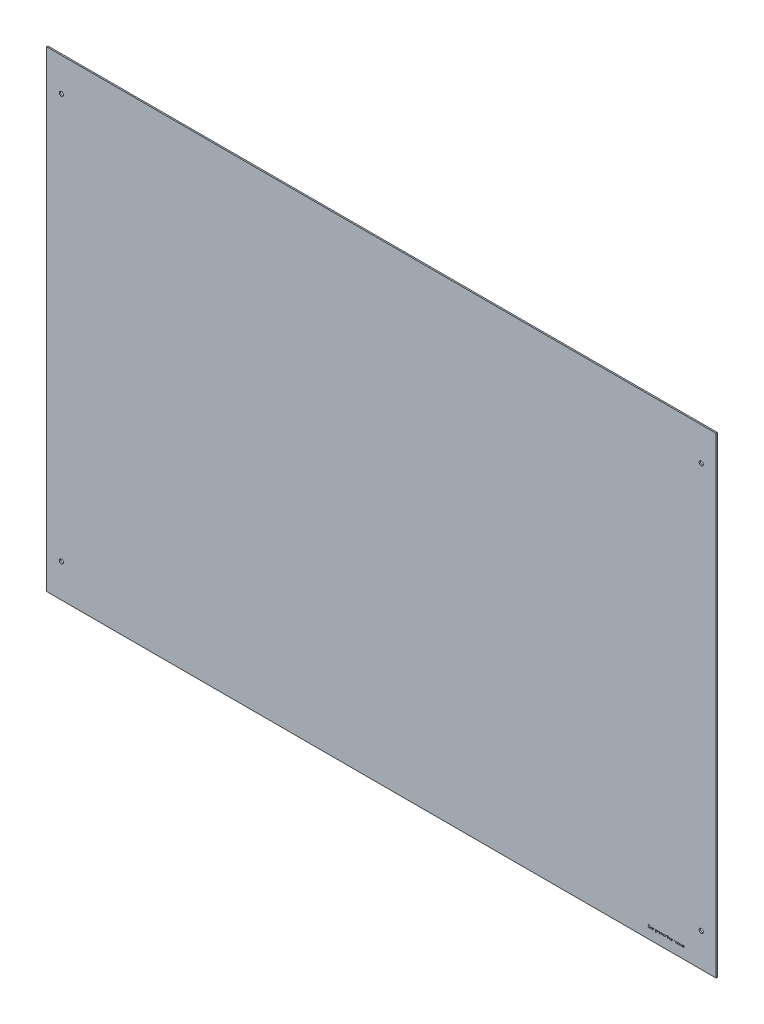
from build123d import *

# Parameters (mm, degrees)
SKETCH1_W           = 1000
SKETCH1_H           = 705
SKETCH1_R           = 3.1
BOSS_EXTRUDE1_DEPTH = 2
CUT_EXTRUDE1_DEPTH  = 1224.531364535


with BuildPart() as part:
    # Sketch1 → Boss-Extrude1 (new body)
    with BuildSketch(Plane.XY):
        with Locations((500, 352.5)):
            Rectangle(SKETCH1_W, SKETCH1_H)
        with Locations((22, 655)):
            Circle(SKETCH1_R, mode=Mode.SUBTRACT)
        with Locations((22, 50)):
            Circle(SKETCH1_R, mode=Mode.SUBTRACT)
        with Locations((978, 50)):
            Circle(SKETCH1_R, mode=Mode.SUBTRACT)
        with Locations((978, 655)):
            Circle(SKETCH1_R, mode=Mode.SUBTRACT)
    extrude(amount=BOSS_EXTRUDE1_DEPTH)

    # Sketch2 → Cut-Extrude1 (cut, through all)
    # profile 1 of 20: a face of its own
    with BuildSketch(Plane.XY.offset(2)):
        with BuildLine():
            Line((901.548089992, 18.010639802), (901.273250249, 17.800303264))
            add(Edge.make_bspline(
                [(901.273250249, 17.800303264), (901.23499932, 17.847273063), (901.174377907, 17.914479398), (901.08672489, 17.996322075), (901.018819923, 18.053575224), (900.947057038, 18.104988876), (900.873197239, 18.153261235), (900.795998938, 18.196527026), (900.689247223, 18.248998802), (900.549599862, 18.303677774), (900.312127383, 18.366066361), (900.126583113, 18.384244537), (900.001415313, 18.383636597)],
                knots=[0, 0, 0, 0, 0.125474941, 0.18712122, 0.248294346, 0.309294856, 0.369850066, 0.430973376, 0.49245599, 0.616147966, 0.740843698, 1, 1, 1, 1], degree=3))
            add(Edge.make_bspline(
                [(900.001415313, 18.383636597), (899.931533862, 18.384556549), (899.827550895, 18.37705799), (899.691130139, 18.356880706), (899.591417857, 18.334790169), (899.493835117, 18.306808221), (899.397742657, 18.273385294), (899.304532073, 18.232029784), (899.21291383, 18.186321706), (899.125134621, 18.134694213), (899.042079572, 18.078380873), (898.964051605, 18.018011774), (898.890988992, 17.953360668), (898.822817045, 17.884718707), (898.760029731, 17.811354366), (898.702844332, 17.733502192), (898.650127263, 17.652188785), (898.602914695, 17.567650991), (898.563384203, 17.479575931), (898.528381368, 17.389471787), (898.500673471, 17.296320782), (898.478781575, 17.200777431), (898.458251351, 17.068606415), (898.451082825, 16.967600744), (898.451936146, 16.899361757)],
                knots=[0, 0, 0, 0, 0.087501875, 0.130462627, 0.172752021, 0.215403067, 0.25764983, 0.300152749, 0.34312149, 0.385925163, 0.427685727, 0.46881795, 0.5094918, 0.549883031, 0.589980023, 0.63040523, 0.670868626, 0.711383944, 0.751627258, 0.791775577, 0.832458919, 0.873319045, 0.914542956, 1, 1, 1, 1], degree=3))
            add(Edge.make_bspline(
                [(898.451936146, 16.899361757), (898.451470264, 16.797760091), (898.465622153, 16.647708603), (898.511273523, 16.454772086), (898.561432487, 16.319391588), (898.623366643, 16.189483406), (898.701603165, 16.0672445), (898.792220825, 15.950827968), (898.896494934, 15.842984942), (899.010900834, 15.744471498), (899.133648725, 15.657719885), (899.264433012, 15.585408809), (899.401809663, 15.525218541), (899.546835693, 15.479016595), (899.753510311, 15.434572261), (899.91418515, 15.421221502), (900.023150088, 15.422098136)],
                knots=[0, 0, 0, 0, 0.126290104, 0.186726469, 0.246146432, 0.305575643, 0.365429386, 0.426326309, 0.488839906, 0.551724972, 0.613918596, 0.675483766, 0.737333897, 0.800229044, 0.864502298, 1, 1, 1, 1], degree=3))
            add(Edge.make_bspline(
                [(900.023150088, 15.422098136), (900.143324294, 15.422064809), (900.321825395, 15.439013649), (900.549720248, 15.500982094), (900.711042539, 15.564804974), (900.86433452, 15.647921401), (901.061910684, 15.784234026), (901.192539849, 15.912600151), (901.273250249, 16.005431469)],
                knots=[0, 0, 0, 0, 0.252948636, 0.374754734, 0.495939754, 0.617180641, 0.740909469, 1, 1, 1, 1], degree=3))
            Line((901.273250249, 16.005431469), (901.548089992, 15.797198296))
            add(Edge.make_bspline(
                [(901.548089992, 15.797198296), (901.504786746, 15.739651836), (901.43595735, 15.656973882), (901.33509294, 15.55595368), (901.255454176, 15.485813637), (901.172331826, 15.419662514), (901.08426074, 15.359359781), (900.992391375, 15.30406915), (900.897036987, 15.253442122), (900.798298348, 15.208525033), (900.696293927, 15.170070735), (900.591463322, 15.136947831), (900.483801919, 15.109688343), (900.373085762, 15.088445911), (900.220269789, 15.069130436), (900.103715258, 15.062553638), (900.025253454, 15.063123777)],
                knots=[0, 0, 0, 0, 0.123053062, 0.183475001, 0.243726501, 0.304278917, 0.364862921, 0.425946204, 0.48739123, 0.549220384, 0.611143589, 0.67352853, 0.736961457, 0.800785283, 0.866012596, 1, 1, 1, 1], degree=3))
            add(Edge.make_bspline(
                [(900.025253454, 15.063123777), (899.950788243, 15.062195603), (899.840704052, 15.068167255), (899.696286216, 15.083767844), (899.592511021, 15.100980107), (899.491385194, 15.121331699), (899.393824569, 15.148601067), (899.298869376, 15.179150733), (899.206901006, 15.215055567), (899.117841404, 15.255571868), (899.031977234, 15.301363108), (898.949350138, 15.352046129), (898.869139731, 15.406496835), (898.792560828, 15.466490259), (898.693688853, 15.553133198), (898.624724177, 15.624552356), (898.581643678, 15.675203103)],
                knots=[0, 0, 0, 0, 0.137749562, 0.203916744, 0.268779862, 0.332413706, 0.39475354, 0.456180032, 0.516995649, 0.577395938, 0.637198344, 0.696999184, 0.756756194, 0.816553905, 0.876947997, 1, 1, 1, 1], degree=3))
            add(Edge.make_bspline(
                [(898.581643678, 15.675203103), (898.509109817, 15.759941508), (898.411632649, 15.895729354), (898.30852838, 16.092084777), (898.246094726, 16.245467104), (898.197398757, 16.405504787), (898.151424212, 16.630959341), (898.137485361, 16.80535777), (898.137833582, 16.923199898)],
                knots=[0, 0, 0, 0, 0.247156016, 0.368779749, 0.490733862, 0.613613772, 0.738957576, 1, 1, 1, 1], degree=3))
            add(Edge.make_bspline(
                [(898.137833582, 16.923199898), (898.137770657, 17.047002078), (898.153463854, 17.230501703), (898.210310919, 17.465942528), (898.269647354, 17.632145136), (898.34496878, 17.791275717), (898.437991032, 17.942116845), (898.54765937, 18.085633647), (898.673106607, 18.21964847), (898.810674026, 18.342187532), (898.957992838, 18.449994797), (899.114774712, 18.539708403), (899.279292859, 18.614719214), (899.452777416, 18.67230811), (899.699351217, 18.727242286), (899.891243442, 18.742358766), (900.021046723, 18.742610956)],
                knots=[0, 0, 0, 0, 0.127013532, 0.18795481, 0.248013913, 0.307747682, 0.368234515, 0.429469844, 0.492743437, 0.556257769, 0.618216786, 0.679655476, 0.741245546, 0.803415265, 0.866815462, 1, 1, 1, 1], degree=3))
            add(Edge.make_bspline(
                [(900.021046723, 18.742610956), (900.100625739, 18.742761847), (900.218749161, 18.737357155), (900.373257004, 18.716337618), (900.484867566, 18.69524314), (900.593990293, 18.669030149), (900.699790505, 18.634891351), (900.802889195, 18.595854419), (900.902636119, 18.550896068), (900.998552606, 18.500429263), (901.090609156, 18.44501378), (901.178073166, 18.384717484), (901.261565138, 18.320056106), (901.339669691, 18.249650838), (901.439921276, 18.150512032), (901.505897042, 18.067367114), (901.548089992, 18.010639802)],
                knots=[0, 0, 0, 0, 0.135682946, 0.20121499, 0.265682235, 0.329266835, 0.392395428, 0.455069762, 0.51712685, 0.578790035, 0.639739863, 0.700191504, 0.759806243, 0.819628319, 0.879354791, 1, 1, 1, 1], degree=3))
        make_face()
    # profile 2 of 20: a face of its own
    with BuildSketch(Plane.XY.offset(2)):
        with BuildLine():
            Line((905.362192556, 17.710559674), (905.67629512, 17.710559674))
            Line((905.67629512, 17.710559674), (905.67629512, 17.266048456))
            add(Edge.make_bspline(
                [(905.67629512, 17.266048456), (905.728980555, 17.341496498), (905.835367012, 17.47437407), (905.965376332, 17.584503617), (906.031062749, 17.625723937)],
                knots=[0, 0, 0, 0, 0.543394841, 1, 1, 1, 1], degree=3))
            add(Edge.make_bspline(
                [(906.031062749, 17.625723937), (906.112651972, 17.667853571), (906.284467546, 17.734538491), (906.467601055, 17.754735832), (906.558306338, 17.755431469)],
                knots=[0, 0, 0, 0, 0.50303512, 1, 1, 1, 1], degree=3))
            add(Edge.make_bspline(
                [(906.558306338, 17.755431469), (906.619366534, 17.754645115), (906.710990726, 17.746892972), (906.828778842, 17.715570459), (906.913391336, 17.683189646), (906.993112341, 17.643935966), (907.066201731, 17.597888088), (907.131824909, 17.546190319), (907.189954836, 17.486512397), (907.24220832, 17.41717219), (907.309956657, 17.303406045), (907.348760185, 17.20635646), (907.372308742, 17.137743168)],
                knots=[0, 0, 0, 0, 0.16653232, 0.248836331, 0.331246145, 0.412957109, 0.490494278, 0.566155792, 0.639987335, 0.716765488, 0.802143905, 1, 1, 1, 1], degree=3))
            add(Edge.make_bspline(
                [(907.372308742, 17.137743168), (907.398431147, 17.186856106), (907.441459341, 17.257257704), (907.505788195, 17.344379903), (907.555806375, 17.40439508), (907.608235192, 17.45970239), (907.663295503, 17.510499461), (907.720680541, 17.556997381), (907.800472837, 17.611330984), (907.904284399, 17.668955823), (908.0788535, 17.736087836), (908.218046992, 17.755653688), (908.310409704, 17.755431469)],
                knots=[0, 0, 0, 0, 0.141225536, 0.209115852, 0.274839653, 0.33948293, 0.402476267, 0.464941889, 0.526832641, 0.647414816, 0.765561512, 1, 1, 1, 1], degree=3))
            add(Edge.make_bspline(
                [(908.310409704, 17.755431469), (908.39407438, 17.754810953), (908.51908999, 17.741097214), (908.673337411, 17.683078818), (908.778809439, 17.624894872), (908.873970595, 17.551702472), (908.956686547, 17.464637164), (909.026457003, 17.364293572), (909.072035638, 17.269901829), (909.10295086, 17.186566461), (909.122012255, 17.115560177), (909.138851264, 17.037408624), (909.152835408, 16.952018354), (909.163041851, 16.859087786), (909.173567215, 16.720542994), (909.176685035, 16.61264703), (909.17629512, 16.538284033)],
                knots=[0, 0, 0, 0, 0.147965015, 0.218796999, 0.289470445, 0.359724218, 0.429707739, 0.50049652, 0.57442902, 0.613947296, 0.65715527, 0.70397277, 0.754938985, 0.809706611, 0.868832954, 1, 1, 1, 1], degree=3))
            Line((909.17629512, 16.538284033), (909.17629512, 15.152867366))
            Line((909.17629512, 15.152867366), (908.862192556, 15.152867366))
            Line((908.862192556, 15.152867366), (908.862192556, 16.539686277))
            add(Edge.make_bspline(
                [(908.862192556, 16.539686277), (908.862263893, 16.6025559), (908.861303364, 16.692881508), (908.854193389, 16.807811798), (908.848262013, 16.881983675), (908.840017465, 16.948232511), (908.829371698, 17.006424921), (908.818093983, 17.057018728), (908.799357999, 17.113104801), (908.769410113, 17.174974839), (908.723792597, 17.241699117), (908.66632263, 17.299777271), (908.599961927, 17.350205927), (908.524415603, 17.39115949), (908.410560692, 17.431400564), (908.318228239, 17.441729416), (908.255722204, 17.441328905)],
                knots=[0, 0, 0, 0, 0.150563303, 0.216151057, 0.275679792, 0.32870705, 0.375904435, 0.417301898, 0.452692748, 0.517265292, 0.581216568, 0.645321894, 0.712024493, 0.780130045, 0.850218226, 1, 1, 1, 1], degree=3))
            add(Edge.make_bspline(
                [(908.255722204, 17.441328905), (908.177185022, 17.442674972), (908.060182812, 17.423393999), (907.913235114, 17.365389427), (907.811017082, 17.303046459), (907.716990075, 17.228213893), (907.63609029, 17.139270699), (907.569258161, 17.038639032), (907.52400417, 16.945492764), (907.495414873, 16.861823258), (907.476537947, 16.788725895), (907.4618546, 16.705644351), (907.448083876, 16.613136734), (907.439096986, 16.510567104), (907.427731836, 16.354579315), (907.426774945, 16.232349956), (907.42629512, 16.147759193)],
                knots=[0, 0, 0, 0, 0.134706602, 0.201864998, 0.270788266, 0.340024294, 0.408082739, 0.476813195, 0.547346064, 0.585639795, 0.628864953, 0.677153203, 0.730802811, 0.789806616, 0.854325009, 1, 1, 1, 1], degree=3))
            Line((907.42629512, 16.147759193), (907.42629512, 15.152867366))
            Line((907.42629512, 15.152867366), (907.112192556, 15.152867366))
            Line((907.112192556, 15.152867366), (907.112192556, 16.453448296))
            add(Edge.make_bspline(
                [(907.112192556, 16.453448296), (907.112248772, 16.52402853), (907.11132407, 16.625329892), (907.104194881, 16.754050794), (907.098317385, 16.836872053), (907.089856518, 16.910283428), (907.080246907, 16.974678177), (907.068898264, 17.029894925), (907.050108385, 17.090458332), (907.021393931, 17.157179102), (906.9752056, 17.22832074), (906.917598283, 17.290586532), (906.850026393, 17.343754138), (906.774024605, 17.387661612), (906.659646106, 17.430950486), (906.566287956, 17.440801738), (906.503618838, 17.441328905)],
                knots=[0, 0, 0, 0, 0.158778855, 0.227738062, 0.289945653, 0.345498839, 0.393896337, 0.436373785, 0.472122274, 0.536383616, 0.599077902, 0.661948234, 0.726310542, 0.791771103, 0.858647304, 1, 1, 1, 1], degree=3))
            add(Edge.make_bspline(
                [(906.503618838, 17.441328905), (906.427810915, 17.441961418), (906.313874982, 17.423762533), (906.171050766, 17.366225505), (906.069095108, 17.306647843), (905.975421223, 17.232726331), (905.893412883, 17.145817412), (905.824470387, 17.046966758), (905.778738533, 16.954802649), (905.749240134, 16.873229313), (905.729644537, 16.803878388), (905.712806047, 16.726878098), (905.700287212, 16.641991145), (905.688226994, 16.549769394), (905.680033954, 16.411242346), (905.675299265, 16.303503102), (905.67629512, 16.229089321)],
                knots=[0, 0, 0, 0, 0.136870959, 0.206114357, 0.277538182, 0.349771978, 0.421250836, 0.492910757, 0.567026589, 0.606614153, 0.649703954, 0.69730315, 0.74908566, 0.804880647, 0.865485006, 1, 1, 1, 1], degree=3))
            Line((905.67629512, 16.229089321), (905.67629512, 15.152867366))
            Line((905.67629512, 15.152867366), (905.362192556, 15.152867366))
            Line((905.362192556, 15.152867366), (905.362192556, 17.710559674))
        make_face()
    # profile 3 of 20: a face of its own
    with BuildSketch(Plane.XY.offset(2)):
        with BuildLine():
            Line((909.894243838, 17.710559674), (910.208346402, 17.710559674))
            Line((910.208346402, 17.710559674), (910.208346402, 17.237302462))
            add(Edge.make_bspline(
                [(910.208346402, 17.237302462), (910.270511638, 17.32261191), (910.37493933, 17.438545489), (910.536217408, 17.56271673), (910.663333179, 17.634146294), (910.797766386, 17.687910051), (910.989001546, 17.742059253), (911.140079264, 17.755110022), (911.241799928, 17.755431469)],
                knots=[0, 0, 0, 0, 0.263044683, 0.386061082, 0.505770653, 0.625178031, 0.746147722, 1, 1, 1, 1], degree=3))
            add(Edge.make_bspline(
                [(911.241799928, 17.755431469), (911.331432659, 17.754533347), (911.464716277, 17.744573608), (911.636150371, 17.703805587), (911.75771673, 17.660438084), (911.874980246, 17.606773697), (911.986202228, 17.539059077), (912.093115802, 17.46065222), (912.193032041, 17.370420251), (912.285353191, 17.272791944), (912.365200161, 17.16776962), (912.434069224, 17.058807149), (912.489749939, 16.944214622), (912.533319328, 16.824897021), (912.575293562, 16.657151542), (912.586038456, 16.526545356), (912.586551531, 16.438724738)],
                knots=[0, 0, 0, 0, 0.128636051, 0.190652902, 0.252125037, 0.313446276, 0.375227279, 0.438498083, 0.5032851, 0.568009687, 0.630878982, 0.692153504, 0.75255215, 0.813191094, 0.8739854, 1, 1, 1, 1], degree=3))
            add(Edge.make_bspline(
                [(912.586551531, 16.438724738), (912.586348291, 16.349215488), (912.574827478, 16.216528284), (912.53417311, 16.04580758), (912.491158306, 15.924530917), (912.435505188, 15.808547106), (912.367803774, 15.697940749), (912.287916443, 15.59274705), (912.196615554, 15.494394091), (912.097562559, 15.403795009), (911.991685065, 15.324556103), (911.880626212, 15.258017769), (911.764953765, 15.202423647), (911.643679178, 15.160573265), (911.473392051, 15.11962248), (911.340863244, 15.108318288), (911.251615633, 15.107995571)],
                knots=[0, 0, 0, 0, 0.128034164, 0.189573725, 0.250579835, 0.311733221, 0.37325008, 0.435762516, 0.500345561, 0.564949367, 0.627527909, 0.68915729, 0.749865012, 0.8107602, 0.872299761, 1, 1, 1, 1], degree=3))
            add(Edge.make_bspline(
                [(911.251615633, 15.107995571), (911.151145425, 15.106835659), (911.002641631, 15.123998852), (910.812317251, 15.176564165), (910.67811573, 15.233182133), (910.549983398, 15.305484123), (910.384920339, 15.42498423), (910.275887732, 15.536169597), (910.208346402, 15.616308873)],
                knots=[0, 0, 0, 0, 0.250547782, 0.371230204, 0.49211577, 0.613400988, 0.73799732, 1, 1, 1, 1], degree=3))
            Line((910.208346402, 15.616308873), (910.208346402, 14.210559674))
            Line((910.208346402, 14.210559674), (909.894243838, 14.210559674))
            Line((909.894243838, 14.210559674), (909.894243838, 17.710559674))
        make_face()
        with BuildLine():
            add(Edge.make_bspline(
                [(911.238995441, 17.441328905), (911.168889791, 17.442361852), (911.065463043, 17.432291335), (910.931802143, 17.402681319), (910.837679055, 17.369813829), (910.74742874, 17.32940327), (910.661744491, 17.278924408), (910.580686958, 17.219271536), (910.504459874, 17.151592429), (910.435596759, 17.07701768), (910.374633192, 16.997429877), (910.323428225, 16.912929772), (910.280917549, 16.824304264), (910.248606816, 16.73085953), (910.217393612, 16.59868827), (910.208543445, 16.495631894), (910.208346402, 16.426104546)],
                knots=[0, 0, 0, 0, 0.130023749, 0.192374057, 0.253884304, 0.314896085, 0.375805828, 0.438242236, 0.501591268, 0.56488076, 0.626533341, 0.687515765, 0.748105916, 0.808795537, 0.870821519, 1, 1, 1, 1], degree=3))
            add(Edge.make_bspline(
                [(910.208346402, 16.426104546), (910.208513604, 16.335327674), (910.223644643, 16.200235061), (910.279672414, 16.030400855), (910.338143026, 15.91294173), (910.412106069, 15.804958679), (910.501200076, 15.708267028), (910.604643714, 15.623480948), (910.720710799, 15.552042056), (910.845132218, 15.494120471), (911.018284158, 15.438412262), (911.153771935, 15.422267701), (911.243903293, 15.422098136)],
                knots=[0, 0, 0, 0, 0.169344011, 0.251060671, 0.332326431, 0.413189279, 0.494299499, 0.57665388, 0.661784919, 0.74776493, 0.831967435, 1, 1, 1, 1], degree=3))
            add(Edge.make_bspline(
                [(911.243903293, 15.422098136), (911.332384107, 15.421561843), (911.464557337, 15.439458029), (911.633481862, 15.494387836), (911.753663942, 15.553869884), (911.866486625, 15.626880832), (911.968369466, 15.714435388), (912.05737199, 15.815926546), (912.133252993, 15.928935704), (912.194322775, 16.050107248), (912.255575744, 16.216530847), (912.271444262, 16.348397587), (912.272448966, 16.435219129)],
                knots=[0, 0, 0, 0, 0.165573796, 0.248158777, 0.332033307, 0.416257349, 0.49952535, 0.58303856, 0.668595904, 0.75403535, 0.8369197, 1, 1, 1, 1], degree=3))
            add(Edge.make_bspline(
                [(912.272448966, 16.435219129), (912.273680501, 16.522739442), (912.254078716, 16.653660147), (912.196577511, 16.82109065), (912.134109497, 16.940614632), (912.059883691, 17.053387507), (911.970143069, 17.152942729), (911.86952535, 17.240109229), (911.756835956, 17.312140153), (911.635897998, 17.369367561), (911.464870987, 17.42591668), (911.329496865, 17.44093393), (911.238995441, 17.441328905)],
                knots=[0, 0, 0, 0, 0.163349297, 0.245826474, 0.33036716, 0.415198374, 0.497940932, 0.580476126, 0.663740011, 0.747512837, 0.830398741, 1, 1, 1, 1], degree=3))
        make_face(mode=Mode.SUBTRACT)
    # profile 4 of 20: a face of its own
    with BuildSketch(Plane.XY.offset(2)):
        with BuildLine():
            Line((913.125013069, 17.710559674), (913.439115633, 17.710559674))
            Line((913.439115633, 17.710559674), (913.439115633, 17.33405727))
            add(Edge.make_bspline(
                [(913.439115633, 17.33405727), (913.482135761, 17.401771229), (913.550087964, 17.495538913), (913.655884857, 17.598229974), (913.73352072, 17.656758254), (913.813901751, 17.700518593), (913.921475043, 17.743195802), (914.007033638, 17.755042452), (914.063114031, 17.755431469)],
                knots=[0, 0, 0, 0, 0.306112383, 0.438366514, 0.560541455, 0.675317225, 0.786113634, 1, 1, 1, 1], degree=3))
            add(Edge.make_bspline(
                [(914.063114031, 17.755431469), (914.108090484, 17.755082048), (914.204557314, 17.738189047), (914.292210426, 17.694651135), (914.336551531, 17.667791244)],
                knots=[0, 0, 0, 0, 0.463523195, 1, 1, 1, 1], degree=3))
            Line((914.336551531, 17.667791244), (914.164075569, 17.395755988))
            add(Edge.make_bspline(
                [(914.164075569, 17.395755988), (914.135462531, 17.408426322), (914.083989873, 17.431681961), (914.028202718, 17.441006516), (914.003518678, 17.441328905)],
                knots=[0, 0, 0, 0, 0.560229945, 1, 1, 1, 1], degree=3))
            add(Edge.make_bspline(
                [(914.003518678, 17.441328905), (913.951993653, 17.441395428), (913.873114403, 17.422517745), (913.778171291, 17.365682432), (913.719996835, 17.317497473), (913.674955027, 17.27093694), (913.6428146, 17.230291352), (913.613332323, 17.184711834), (913.585160284, 17.134982758), (913.559501351, 17.080251313), (913.526649911, 16.999196468), (913.507128524, 16.934718588), (913.495205377, 16.890247174)],
                knots=[0, 0, 0, 0, 0.191338128, 0.295190617, 0.410312337, 0.471930251, 0.536425159, 0.603118728, 0.674117672, 0.749332023, 0.828283384, 1, 1, 1, 1], degree=3))
            add(Edge.make_bspline(
                [(913.495205377, 16.890247174), (913.483455558, 16.84558934), (913.471991604, 16.770417278), (913.459767844, 16.660677896), (913.452619677, 16.557741272), (913.446066526, 16.441125536), (913.440792247, 16.257869958), (913.438569176, 16.113423348), (913.439115633, 16.012442687)],
                knots=[0, 0, 0, 0, 0.15693815, 0.258600395, 0.37589093, 0.508166168, 0.656237809, 1, 1, 1, 1], degree=3))
            Line((913.439115633, 16.012442687), (913.439115633, 15.152867366))
            Line((913.439115633, 15.152867366), (913.125013069, 15.152867366))
            Line((913.125013069, 15.152867366), (913.125013069, 17.710559674))
        make_face()
    # profile 5 of 20: a face of its own
    with BuildSketch(Plane.XY.offset(2)):
        with BuildLine():
            Line((916.749812749, 15.960559674), (917.028859223, 15.814025219))
            add(Edge.make_bspline(
                [(917.028859223, 15.814025219), (916.987358387, 15.736332584), (916.917887396, 15.627336699), (916.810941512, 15.497574544), (916.725868519, 15.415828126), (916.636190913, 15.344581176), (916.541460326, 15.282241659), (916.441171011, 15.229125577), (916.335321194, 15.184364886), (916.223022545, 15.149986651), (916.060639272, 15.116660953), (915.93376279, 15.108006732), (915.847468999, 15.107995571)],
                knots=[0, 0, 0, 0, 0.181660766, 0.265874227, 0.346354784, 0.424599862, 0.501903184, 0.579992091, 0.658443431, 0.738672236, 0.821894148, 1, 1, 1, 1], degree=3))
            add(Edge.make_bspline(
                [(915.847468999, 15.107995571), (915.751698319, 15.108034454), (915.610776623, 15.119030737), (915.43154478, 15.162177093), (915.308334728, 15.206102766), (915.193592049, 15.263540394), (915.087091305, 15.333497142), (914.98827176, 15.415630138), (914.900247514, 15.510646381), (914.821003795, 15.612328384), (914.751077376, 15.718284285), (914.692622118, 15.828247401), (914.645061538, 15.941518335), (914.606686141, 16.057380711), (914.570604856, 16.217827855), (914.561825232, 16.341679662), (914.560910505, 16.424702302)],
                knots=[0, 0, 0, 0, 0.139629225, 0.204796697, 0.268134963, 0.329813747, 0.391301398, 0.453433515, 0.51655169, 0.579631271, 0.641118921, 0.701294047, 0.760810336, 0.819931722, 0.878919575, 1, 1, 1, 1], degree=3))
            add(Edge.make_bspline(
                [(914.560910505, 16.424702302), (914.561863793, 16.502496004), (914.569139873, 16.618624865), (914.600767253, 16.769168575), (914.632914685, 16.878056267), (914.674493787, 16.983596517), (914.742666564, 17.121107553), (914.807830396, 17.217176825), (914.855381659, 17.278668648)],
                knots=[0, 0, 0, 0, 0.2537679, 0.377428427, 0.500550841, 0.623295883, 0.746578332, 1, 1, 1, 1], degree=3))
            add(Edge.make_bspline(
                [(914.855381659, 17.278668648), (914.915954719, 17.354393197), (915.014722694, 17.460275033), (915.169384846, 17.57103756), (915.290961869, 17.639077105), (915.421303304, 17.690709635), (915.60784933, 17.743204038), (915.755725127, 17.754232889), (915.855181338, 17.755431469)],
                knots=[0, 0, 0, 0, 0.253589335, 0.374643257, 0.495340042, 0.616324775, 0.739759335, 1, 1, 1, 1], degree=3))
            add(Edge.make_bspline(
                [(915.855181338, 17.755431469), (915.95800884, 17.755863442), (916.109917101, 17.740983237), (916.302510164, 17.687693987), (916.43635451, 17.632608355), (916.562024021, 17.561396608), (916.720299197, 17.442325823), (916.823742111, 17.332686133), (916.885129255, 17.25202602)],
                knots=[0, 0, 0, 0, 0.259032841, 0.381879824, 0.502258444, 0.62275219, 0.744742632, 1, 1, 1, 1], degree=3))
            add(Edge.make_bspline(
                [(916.885129255, 17.25202602), (916.931015907, 17.193137197), (916.990924947, 17.097498033), (917.054535715, 16.960712012), (917.092912493, 16.851830278), (917.123922626, 16.738003927), (917.154524109, 16.575647809), (917.161885143, 16.449665469), (917.163474608, 16.364405828)],
                knots=[0, 0, 0, 0, 0.236254763, 0.356174434, 0.477249655, 0.601539871, 0.729618382, 1, 1, 1, 1], degree=3))
            Line((917.163474608, 16.364405828), (914.875013069, 16.364405828))
            add(Edge.make_bspline(
                [(914.875013069, 16.364405828), (914.876801794, 16.298159817), (914.88568214, 16.200303559), (914.915962671, 16.075090267), (914.947208436, 15.988007688), (914.98508135, 15.905077441), (915.031465447, 15.826915432), (915.08680544, 15.753877507), (915.148531018, 15.68531032), (915.217238148, 15.624249748), (915.289520878, 15.569597284), (915.36641448, 15.523794209), (915.447312433, 15.486604947), (915.532084708, 15.457533876), (915.652066773, 15.430467416), (915.745195024, 15.421748451), (915.808206178, 15.422098136)],
                knots=[0, 0, 0, 0, 0.134475588, 0.198391058, 0.260753477, 0.321829223, 0.383037238, 0.444653123, 0.507398011, 0.569825238, 0.630777641, 0.690928687, 0.750945133, 0.811049477, 0.872330853, 1, 1, 1, 1], degree=3))
            add(Edge.make_bspline(
                [(915.808206178, 15.422098136), (915.870400082, 15.421797305), (915.963696314, 15.429120366), (916.085544608, 15.454639948), (916.174805351, 15.480498225), (916.260376163, 15.512083456), (916.339622061, 15.550183968), (916.412501005, 15.59233511), (916.480622624, 15.640541468), (916.546674464, 15.699562793), (916.640172253, 15.804381725), (916.707288023, 15.89401219), (916.749812749, 15.960559674)],
                knots=[0, 0, 0, 0, 0.163878894, 0.24565874, 0.327725695, 0.408609961, 0.485749086, 0.559169056, 0.630268476, 0.705306028, 0.792064966, 1, 1, 1, 1], degree=3))
        make_face()
        with BuildLine():
            Line((914.907965793, 16.678508392), (916.849372043, 16.678508392))
            add(Edge.make_bspline(
                [(916.849372043, 16.678508392), (916.829498244, 16.759249406), (916.789882868, 16.87317067), (916.717411481, 17.010080606), (916.655825768, 17.095669158), (916.585997756, 17.171670121), (916.505355161, 17.23809038), (916.4149184, 17.297503534), (916.315160057, 17.347672386), (916.209515943, 17.390299874), (916.061708463, 17.428865797), (915.947749544, 17.442469901), (915.87130714, 17.441328905)],
                knots=[0, 0, 0, 0, 0.185231261, 0.267500523, 0.344400382, 0.419594869, 0.496890627, 0.576637919, 0.660267852, 0.745386615, 0.830040327, 1, 1, 1, 1], degree=3))
            add(Edge.make_bspline(
                [(915.87130714, 17.441328905), (915.809381782, 17.441481042), (915.717347889, 17.434784338), (915.599005722, 17.409056692), (915.514297895, 17.383121026), (915.433689591, 17.348494456), (915.328669565, 17.294078873), (915.257769522, 17.239836265), (915.212252652, 17.201545251)],
                knots=[0, 0, 0, 0, 0.259141276, 0.384161763, 0.505991952, 0.629098089, 0.750669123, 1, 1, 1, 1], degree=3))
            add(Edge.make_bspline(
                [(915.212252652, 17.201545251), (915.177371973, 17.172162737), (915.130165599, 17.121280567), (915.073436103, 17.046501297), (915.034073398, 16.983484594), (914.998015116, 16.914852999), (914.951796886, 16.814233153), (914.924399999, 16.733840234), (914.907965793, 16.678508392)],
                knots=[0, 0, 0, 0, 0.222580497, 0.338499871, 0.458708565, 0.585535346, 0.717517743, 1, 1, 1, 1], degree=3))
        make_face(mode=Mode.SUBTRACT)
    # profile 6 of 20: a face of its own
    with BuildSketch(Plane.XY.offset(2)):
        with BuildLine():
            Line((919.003218197, 17.391549257), (918.790077172, 17.172098136))
            add(Edge.make_bspline(
                [(918.790077172, 17.172098136), (918.755259851, 17.213627162), (918.701790853, 17.27157139), (918.623968778, 17.33556604), (918.568930155, 17.374537859), (918.513468734, 17.40394241), (918.441405826, 17.432188037), (918.385185315, 17.441296139), (918.348370441, 17.441328905)],
                knots=[0, 0, 0, 0, 0.305035505, 0.441308964, 0.565963227, 0.683525114, 0.79333413, 1, 1, 1, 1], degree=3))
            add(Edge.make_bspline(
                [(918.348370441, 17.441328905), (918.304720663, 17.442223648), (918.239614243, 17.428130646), (918.162291595, 17.384564128), (918.112119287, 17.338662179), (918.069682183, 17.285881635), (918.027994617, 17.207027776), (918.016162202, 17.141022756), (918.01603871, 17.097078103)],
                knots=[0, 0, 0, 0, 0.245900629, 0.36916603, 0.498510841, 0.628503866, 0.751028329, 1, 1, 1, 1], degree=3))
            add(Edge.make_bspline(
                [(918.01603871, 17.097078103), (918.016114226, 17.05671257), (918.03180037, 16.97256873), (918.076287624, 16.899535841), (918.102977813, 16.865006789)],
                knots=[0, 0, 0, 0, 0.479403194, 1, 1, 1, 1], degree=3))
            add(Edge.make_bspline(
                [(918.102977813, 16.865006789), (918.118960323, 16.843292301), (918.15016937, 16.81375728), (918.195746054, 16.773573577), (918.239032603, 16.741604664), (918.287800915, 16.707994761), (918.364647633, 16.660583533), (918.42484018, 16.623996126), (918.468262268, 16.601384994)],
                knots=[0, 0, 0, 0, 0.177559821, 0.28398236, 0.402216747, 0.53356848, 0.676120994, 1, 1, 1, 1], degree=3))
            add(Edge.make_bspline(
                [(918.468262268, 16.601384994), (918.520982196, 16.572254845), (918.596835479, 16.528376576), (918.690519765, 16.465545564), (918.751984691, 16.420888277), (918.805903271, 16.375718026), (918.867598788, 16.319515741), (918.906734654, 16.273706979), (918.928899287, 16.242410636)],
                knots=[0, 0, 0, 0, 0.307114592, 0.446213159, 0.574876072, 0.69415211, 0.80458118, 1, 1, 1, 1], degree=3))
            add(Edge.make_bspline(
                [(918.928899287, 16.242410636), (918.966953517, 16.184876404), (919.031030369, 16.058225257), (919.047088987, 15.917221869), (919.048089992, 15.846977943)],
                knots=[0, 0, 0, 0, 0.495235025, 1, 1, 1, 1], degree=3))
            add(Edge.make_bspline(
                [(919.048089992, 15.846977943), (919.04761809, 15.79725), (919.042120068, 15.723175465), (919.019125002, 15.62844276), (918.996049649, 15.560748791), (918.964860323, 15.496789498), (918.928313857, 15.434953342), (918.884438579, 15.376577393), (918.834347305, 15.321738411), (918.779501787, 15.271652768), (918.720995641, 15.227628433), (918.658756863, 15.191055493), (918.593229858, 15.160784911), (918.524266981, 15.136736575), (918.426274778, 15.11408508), (918.34998028, 15.10834567), (918.298590793, 15.107995571)],
                knots=[0, 0, 0, 0, 0.127199133, 0.188597338, 0.248639515, 0.309524699, 0.370036991, 0.431889244, 0.495704286, 0.559519328, 0.62137158, 0.682397107, 0.743568482, 0.805498484, 0.868639701, 1, 1, 1, 1], degree=3))
            add(Edge.make_bspline(
                [(918.298590793, 15.107995571), (918.228330784, 15.107462552), (918.123131955, 15.119588293), (917.987572817, 15.15830533), (917.889177822, 15.197958919), (917.796172798, 15.248156803), (917.682931936, 15.32774846), (917.609588552, 15.400750836), (917.567320761, 15.454349738)],
                knots=[0, 0, 0, 0, 0.251723961, 0.377218688, 0.504693549, 0.631458239, 0.755401067, 1, 1, 1, 1], degree=3))
            Line((917.567320761, 15.454349738), (917.775553934, 15.691328905))
            add(Edge.make_bspline(
                [(917.775553934, 15.691328905), (917.813203855, 15.64943381), (917.871497199, 15.590744319), (917.957348057, 15.527258422), (918.020170983, 15.488594984), (918.084394758, 15.458862668), (918.170856493, 15.430945391), (918.23800881, 15.421882949), (918.282464992, 15.422098136)],
                knots=[0, 0, 0, 0, 0.285904172, 0.417171648, 0.540500744, 0.659237718, 0.775006098, 1, 1, 1, 1], degree=3))
            add(Edge.make_bspline(
                [(918.282464992, 15.422098136), (918.3416732, 15.421585706), (918.429492848, 15.436872933), (918.535197347, 15.488645688), (918.60324206, 15.542665535), (918.661065219, 15.605637793), (918.717201909, 15.699959099), (918.734318683, 15.780438068), (918.733987428, 15.833656629)],
                knots=[0, 0, 0, 0, 0.261895674, 0.387836045, 0.517686206, 0.644508654, 0.764718263, 1, 1, 1, 1], degree=3))
            add(Edge.make_bspline(
                [(918.733987428, 15.833656629), (918.733820077, 15.877626247), (918.719828543, 15.965916487), (918.675638969, 16.043696305), (918.647749447, 16.077647014)],
                knots=[0, 0, 0, 0, 0.500453315, 1, 1, 1, 1], degree=3))
            add(Edge.make_bspline(
                [(918.647749447, 16.077647014), (918.63090245, 16.097914243), (918.599703006, 16.127322393), (918.551797168, 16.165411808), (918.506680034, 16.197765414), (918.454680586, 16.23135213), (918.372024406, 16.27995702), (918.306398987, 16.316811806), (918.260029095, 16.341268809)],
                knots=[0, 0, 0, 0, 0.167461676, 0.272270023, 0.389550841, 0.520801368, 0.666263293, 1, 1, 1, 1], degree=3))
            add(Edge.make_bspline(
                [(918.260029095, 16.341268809), (918.209434878, 16.369235889), (918.136448238, 16.410922937), (918.047378089, 16.472591811), (917.988267642, 16.515494399), (917.936135405, 16.558937959), (917.878221678, 16.615303343), (917.839962565, 16.659360203), (917.819023486, 16.690427462)],
                knots=[0, 0, 0, 0, 0.305950213, 0.443775499, 0.572824362, 0.692154156, 0.802295707, 1, 1, 1, 1], degree=3))
            add(Edge.make_bspline(
                [(917.819023486, 16.690427462), (917.779754715, 16.746822256), (917.721380852, 16.874720744), (917.700664373, 17.013738836), (917.701936146, 17.084457911)],
                knots=[0, 0, 0, 0, 0.492590796, 1, 1, 1, 1], degree=3))
            add(Edge.make_bspline(
                [(917.701936146, 17.084457911), (917.702252935, 17.130600224), (917.706381385, 17.199235091), (917.727062554, 17.286809976), (917.746103666, 17.348935021), (917.772590287, 17.407437591), (917.804235226, 17.463094937), (917.841422913, 17.51583088), (917.884266132, 17.564834041), (917.931372798, 17.609343227), (917.982267558, 17.648142371), (918.035805832, 17.681246838), (918.092214192, 17.709019028), (918.152034892, 17.729993739), (918.237211897, 17.749736861), (918.303457379, 17.755966032), (918.348370441, 17.755431469)],
                knots=[0, 0, 0, 0, 0.133043535, 0.196507438, 0.258613417, 0.319728338, 0.380872854, 0.442635602, 0.505079304, 0.56788052, 0.628813854, 0.688910091, 0.748765006, 0.809385783, 0.870884336, 1, 1, 1, 1], degree=3))
            add(Edge.make_bspline(
                [(918.348370441, 17.755431469), (918.403265733, 17.75537828), (918.487148493, 17.743687012), (918.595043602, 17.705216446), (918.677372358, 17.665038523), (918.759160808, 17.612936746), (918.872667496, 17.526059043), (918.95261014, 17.448843825), (919.003218197, 17.391549257)],
                knots=[0, 0, 0, 0, 0.213411613, 0.32612673, 0.444451672, 0.56906108, 0.702712204, 1, 1, 1, 1], degree=3))
        make_face()
    # profile 7 of 20: a face of its own
    with BuildSketch(Plane.XY.offset(2)):
        with BuildLine():
            Line((920.887833582, 17.391549257), (920.674692556, 17.172098136))
            add(Edge.make_bspline(
                [(920.674692556, 17.172098136), (920.639875235, 17.213627162), (920.586406238, 17.27157139), (920.508584163, 17.33556604), (920.453545539, 17.374537859), (920.398084119, 17.40394241), (920.326021211, 17.432188037), (920.269800699, 17.441296139), (920.232985825, 17.441328905)],
                knots=[0, 0, 0, 0, 0.305035505, 0.441308964, 0.565963227, 0.683525114, 0.79333413, 1, 1, 1, 1], degree=3))
            add(Edge.make_bspline(
                [(920.232985825, 17.441328905), (920.189336048, 17.442223648), (920.124229627, 17.428130646), (920.046906979, 17.384564128), (919.996734672, 17.338662179), (919.954297567, 17.285881635), (919.912610002, 17.207027776), (919.900777587, 17.141022756), (919.900654095, 17.097078103)],
                knots=[0, 0, 0, 0, 0.245900629, 0.36916603, 0.498510841, 0.628503866, 0.751028329, 1, 1, 1, 1], degree=3))
            add(Edge.make_bspline(
                [(919.900654095, 17.097078103), (919.900729611, 17.05671257), (919.916415754, 16.97256873), (919.960903008, 16.899535841), (919.987593197, 16.865006789)],
                knots=[0, 0, 0, 0, 0.479403194, 1, 1, 1, 1], degree=3))
            add(Edge.make_bspline(
                [(919.987593197, 16.865006789), (920.003575707, 16.843292301), (920.034784755, 16.81375728), (920.080361438, 16.773573577), (920.123647987, 16.741604664), (920.1724163, 16.707994761), (920.249263018, 16.660583533), (920.309455565, 16.623996126), (920.352877652, 16.601384994)],
                knots=[0, 0, 0, 0, 0.177559821, 0.28398236, 0.402216747, 0.53356848, 0.676120994, 1, 1, 1, 1], degree=3))
            add(Edge.make_bspline(
                [(920.352877652, 16.601384994), (920.405597581, 16.572254845), (920.481450864, 16.528376576), (920.57513515, 16.465545564), (920.636600076, 16.420888277), (920.690518656, 16.375718026), (920.752214173, 16.319515741), (920.791350039, 16.273706979), (920.813514672, 16.242410636)],
                knots=[0, 0, 0, 0, 0.307114592, 0.446213159, 0.574876072, 0.69415211, 0.80458118, 1, 1, 1, 1], degree=3))
            add(Edge.make_bspline(
                [(920.813514672, 16.242410636), (920.851568901, 16.184876404), (920.915645754, 16.058225257), (920.931704372, 15.917221869), (920.932705377, 15.846977943)],
                knots=[0, 0, 0, 0, 0.495235025, 1, 1, 1, 1], degree=3))
            add(Edge.make_bspline(
                [(920.932705377, 15.846977943), (920.932233474, 15.79725), (920.926735453, 15.723175465), (920.903740386, 15.62844276), (920.880665033, 15.560748791), (920.849475708, 15.496789498), (920.812929242, 15.434953342), (920.769053964, 15.376577393), (920.718962689, 15.321738411), (920.664117172, 15.271652768), (920.605611026, 15.227628433), (920.543372248, 15.191055493), (920.477845243, 15.160784911), (920.408882365, 15.136736575), (920.310890163, 15.11408508), (920.234595664, 15.10834567), (920.183206178, 15.107995571)],
                knots=[0, 0, 0, 0, 0.127199133, 0.188597338, 0.248639515, 0.309524699, 0.370036991, 0.431889244, 0.495704286, 0.559519328, 0.62137158, 0.682397107, 0.743568482, 0.805498484, 0.868639701, 1, 1, 1, 1], degree=3))
            add(Edge.make_bspline(
                [(920.183206178, 15.107995571), (920.112946168, 15.107462552), (920.007747339, 15.119588293), (919.872188202, 15.15830533), (919.773793206, 15.197958919), (919.680788182, 15.248156803), (919.56754732, 15.32774846), (919.494203937, 15.400750836), (919.451936146, 15.454349738)],
                knots=[0, 0, 0, 0, 0.251723961, 0.377218688, 0.504693549, 0.631458239, 0.755401067, 1, 1, 1, 1], degree=3))
            Line((919.451936146, 15.454349738), (919.660169319, 15.691328905))
            add(Edge.make_bspline(
                [(919.660169319, 15.691328905), (919.69781924, 15.64943381), (919.756112584, 15.590744319), (919.841963441, 15.527258422), (919.904786368, 15.488594984), (919.969010143, 15.458862668), (920.055471878, 15.430945391), (920.122624194, 15.421882949), (920.167080377, 15.422098136)],
                knots=[0, 0, 0, 0, 0.285904172, 0.417171648, 0.540500744, 0.659237718, 0.775006098, 1, 1, 1, 1], degree=3))
            add(Edge.make_bspline(
                [(920.167080377, 15.422098136), (920.226288585, 15.421585706), (920.314108232, 15.436872933), (920.419812732, 15.488645688), (920.487857445, 15.542665535), (920.545680603, 15.605637793), (920.601817294, 15.699959099), (920.618934068, 15.780438068), (920.618602813, 15.833656629)],
                knots=[0, 0, 0, 0, 0.261895674, 0.387836045, 0.517686206, 0.644508654, 0.764718263, 1, 1, 1, 1], degree=3))
            add(Edge.make_bspline(
                [(920.618602813, 15.833656629), (920.618435462, 15.877626247), (920.604443927, 15.965916487), (920.560254354, 16.043696305), (920.532364832, 16.077647014)],
                knots=[0, 0, 0, 0, 0.500453315, 1, 1, 1, 1], degree=3))
            add(Edge.make_bspline(
                [(920.532364832, 16.077647014), (920.515517835, 16.097914243), (920.48431839, 16.127322393), (920.436412553, 16.165411808), (920.391295419, 16.197765414), (920.33929597, 16.23135213), (920.25663979, 16.27995702), (920.191014372, 16.316811806), (920.144644479, 16.341268809)],
                knots=[0, 0, 0, 0, 0.167461676, 0.272270023, 0.389550841, 0.520801368, 0.666263293, 1, 1, 1, 1], degree=3))
            add(Edge.make_bspline(
                [(920.144644479, 16.341268809), (920.094050263, 16.369235889), (920.021063623, 16.410922937), (919.931993474, 16.472591811), (919.872883026, 16.515494399), (919.820750789, 16.558937959), (919.762837062, 16.615303343), (919.72457795, 16.659360203), (919.70363887, 16.690427462)],
                knots=[0, 0, 0, 0, 0.305950213, 0.443775499, 0.572824362, 0.692154156, 0.802295707, 1, 1, 1, 1], degree=3))
            add(Edge.make_bspline(
                [(919.70363887, 16.690427462), (919.6643701, 16.746822256), (919.605996236, 16.874720744), (919.585279757, 17.013738836), (919.586551531, 17.084457911)],
                knots=[0, 0, 0, 0, 0.492590796, 1, 1, 1, 1], degree=3))
            add(Edge.make_bspline(
                [(919.586551531, 17.084457911), (919.586868319, 17.130600224), (919.59099677, 17.199235091), (919.611677939, 17.286809976), (919.630719051, 17.348935021), (919.657205672, 17.407437591), (919.688850611, 17.463094937), (919.726038298, 17.51583088), (919.768881517, 17.564834041), (919.815988183, 17.609343227), (919.866882943, 17.648142371), (919.920421217, 17.681246838), (919.976829576, 17.709019028), (920.036650277, 17.729993739), (920.121827281, 17.749736861), (920.188072764, 17.755966032), (920.232985825, 17.755431469)],
                knots=[0, 0, 0, 0, 0.133043535, 0.196507438, 0.258613417, 0.319728338, 0.380872854, 0.442635602, 0.505079304, 0.56788052, 0.628813854, 0.688910091, 0.748765006, 0.809385783, 0.870884336, 1, 1, 1, 1], degree=3))
            add(Edge.make_bspline(
                [(920.232985825, 17.755431469), (920.287881118, 17.75537828), (920.371763877, 17.743687012), (920.479658987, 17.705216446), (920.561987742, 17.665038523), (920.643776193, 17.612936746), (920.75728288, 17.526059043), (920.837225525, 17.448843825), (920.887833582, 17.391549257)],
                knots=[0, 0, 0, 0, 0.213411613, 0.32612673, 0.444451672, 0.56906108, 0.702712204, 1, 1, 1, 1], degree=3))
        make_face()
    # profile 8 of 20: a face of its own
    with BuildSketch(Plane.XY.offset(2)):
        with BuildLine():
            Line((924.657064351, 17.710559674), (924.971166915, 17.710559674))
            Line((924.971166915, 17.710559674), (924.971166915, 17.33405727))
            add(Edge.make_bspline(
                [(924.971166915, 17.33405727), (925.014187043, 17.401771229), (925.082139246, 17.495538913), (925.187936139, 17.598229974), (925.265572002, 17.656758254), (925.345953033, 17.700518593), (925.453526325, 17.743195802), (925.53908492, 17.755042452), (925.595165313, 17.755431469)],
                knots=[0, 0, 0, 0, 0.306112383, 0.438366514, 0.560541455, 0.675317225, 0.786113634, 1, 1, 1, 1], degree=3))
            add(Edge.make_bspline(
                [(925.595165313, 17.755431469), (925.640141766, 17.755082048), (925.736608596, 17.738189047), (925.824261708, 17.694651135), (925.868602813, 17.667791244)],
                knots=[0, 0, 0, 0, 0.463523195, 1, 1, 1, 1], degree=3))
            Line((925.868602813, 17.667791244), (925.696126851, 17.395755988))
            add(Edge.make_bspline(
                [(925.696126851, 17.395755988), (925.667513813, 17.408426322), (925.616041155, 17.431681961), (925.560254, 17.441006516), (925.53556996, 17.441328905)],
                knots=[0, 0, 0, 0, 0.560229945, 1, 1, 1, 1], degree=3))
            add(Edge.make_bspline(
                [(925.53556996, 17.441328905), (925.484044935, 17.441395428), (925.405165685, 17.422517745), (925.310222573, 17.365682432), (925.252048118, 17.317497473), (925.207006309, 17.27093694), (925.174865882, 17.230291352), (925.145383605, 17.184711834), (925.117211566, 17.134982758), (925.091552633, 17.080251313), (925.058701193, 16.999196468), (925.039179806, 16.934718588), (925.027256659, 16.890247174)],
                knots=[0, 0, 0, 0, 0.191338128, 0.295190617, 0.410312337, 0.471930251, 0.536425159, 0.603118728, 0.674117672, 0.749332023, 0.828283384, 1, 1, 1, 1], degree=3))
            add(Edge.make_bspline(
                [(925.027256659, 16.890247174), (925.01550684, 16.84558934), (925.004042886, 16.770417278), (924.991819126, 16.660677896), (924.984670959, 16.557741272), (924.978117808, 16.441125536), (924.972843529, 16.257869958), (924.970620458, 16.113423348), (924.971166915, 16.012442687)],
                knots=[0, 0, 0, 0, 0.15693815, 0.258600395, 0.37589093, 0.508166168, 0.656237809, 1, 1, 1, 1], degree=3))
            Line((924.971166915, 16.012442687), (924.971166915, 15.152867366))
            Line((924.971166915, 15.152867366), (924.657064351, 15.152867366))
            Line((924.657064351, 15.152867366), (924.657064351, 17.710559674))
        make_face()
    # profile 9 of 20: a face of its own
    with BuildSketch(Plane.XY.offset(2)):
        with BuildLine():
            Line((928.6057823, 18.721577302), (928.6057823, 18.394854546))
            add(Edge.make_bspline(
                [(928.6057823, 18.394854546), (928.549736208, 18.418263016), (928.445991564, 18.456060587), (928.33674585, 18.473192191), (928.287473005, 18.473380187)],
                knots=[0, 0, 0, 0, 0.553028173, 1, 1, 1, 1], degree=3))
            add(Edge.make_bspline(
                [(928.287473005, 18.473380187), (928.257329165, 18.472229841), (928.212806781, 18.470029146), (928.15856492, 18.45193552), (928.123662537, 18.434908073), (928.094711301, 18.413553451), (928.069925253, 18.392098287), (928.051958685, 18.367913083), (928.042203736, 18.345392679), (928.03625376, 18.324541684), (928.034463508, 18.30318742), (928.030079248, 18.27696332), (928.028853257, 18.244799672), (928.026081054, 18.207696626), (928.026333814, 18.147097542), (928.02307457, 18.099253043), (928.024552332, 18.065327302)],
                knots=[0, 0, 0, 0, 0.158723881, 0.22942429, 0.297719362, 0.360776094, 0.416987544, 0.468545574, 0.516674948, 0.54453398, 0.581509313, 0.628334039, 0.683432546, 0.749506043, 0.822818186, 1, 1, 1, 1], degree=3))
            Line((928.024552332, 18.065327302), (928.024552332, 17.710559674))
            Line((928.024552332, 17.710559674), (928.560910505, 17.710559674))
            Line((928.560910505, 17.710559674), (928.560910505, 17.39645711))
            Line((928.560910505, 17.39645711), (928.02385121, 17.39645711))
            Line((928.02385121, 17.39645711), (928.022448966, 15.152867366))
            Line((928.022448966, 15.152867366), (927.708346402, 15.152867366))
            Line((927.708346402, 15.152867366), (927.708346402, 17.39645711))
            Line((927.708346402, 17.39645711), (927.349372043, 17.39645711))
            Line((927.349372043, 17.39645711), (927.349372043, 17.710559674))
            Line((927.349372043, 17.710559674), (927.708346402, 17.710559674))
            Line((927.708346402, 17.710559674), (927.708346402, 18.11931368))
            add(Edge.make_bspline(
                [(927.708346402, 18.11931368), (927.707495928, 18.162842259), (927.710603451, 18.225453263), (927.714714883, 18.305922721), (927.720468608, 18.358511781), (927.727133493, 18.406357827), (927.736668915, 18.448750731), (927.745680453, 18.486832483), (927.762029002, 18.529935152), (927.786451229, 18.578785102), (927.82598147, 18.630409304), (927.873374283, 18.676713088), (927.929983386, 18.715725061), (927.993695825, 18.748122199), (928.090949003, 18.780105253), (928.169658677, 18.786572894), (928.2229698, 18.787482751)],
                knots=[0, 0, 0, 0, 0.133856433, 0.192947832, 0.247915963, 0.29664228, 0.341504354, 0.381630214, 0.416904813, 0.483173328, 0.548916672, 0.616061618, 0.68630213, 0.759645114, 0.835389552, 1, 1, 1, 1], degree=3))
            add(Edge.make_bspline(
                [(928.2229698, 18.787482751), (928.281923823, 18.78679921), (928.411740763, 18.774729258), (928.537622459, 18.740881442), (928.6057823, 18.721577302)],
                knots=[0, 0, 0, 0, 0.453862855, 1, 1, 1, 1], degree=3))
        make_face()
    # profile 10 of 20: a face of its own
    with BuildSketch(Plane.XY.offset(2)):
        with BuildLine():
            Line((928.964756659, 17.710559674), (929.278859223, 17.710559674))
            Line((929.278859223, 17.710559674), (929.278859223, 17.33405727))
            add(Edge.make_bspline(
                [(929.278859223, 17.33405727), (929.321879351, 17.401771229), (929.389831553, 17.495538913), (929.495628447, 17.598229974), (929.57326431, 17.656758254), (929.65364534, 17.700518593), (929.761218633, 17.743195802), (929.846777228, 17.755042452), (929.90285762, 17.755431469)],
                knots=[0, 0, 0, 0, 0.306112383, 0.438366514, 0.560541455, 0.675317225, 0.786113634, 1, 1, 1, 1], degree=3))
            add(Edge.make_bspline(
                [(929.90285762, 17.755431469), (929.947834073, 17.755082048), (930.044300904, 17.738189047), (930.131954015, 17.694651135), (930.17629512, 17.667791244)],
                knots=[0, 0, 0, 0, 0.463523195, 1, 1, 1, 1], degree=3))
            Line((930.17629512, 17.667791244), (930.003819159, 17.395755988))
            add(Edge.make_bspline(
                [(930.003819159, 17.395755988), (929.975206121, 17.408426322), (929.923733463, 17.431681961), (929.867946308, 17.441006516), (929.843262268, 17.441328905)],
                knots=[0, 0, 0, 0, 0.560229945, 1, 1, 1, 1], degree=3))
            add(Edge.make_bspline(
                [(929.843262268, 17.441328905), (929.791737243, 17.441395428), (929.712857992, 17.422517745), (929.61791488, 17.365682432), (929.559740425, 17.317497473), (929.514698616, 17.27093694), (929.48255819, 17.230291352), (929.453075913, 17.184711834), (929.424903874, 17.134982758), (929.399244941, 17.080251313), (929.366393501, 16.999196468), (929.346872114, 16.934718588), (929.334948966, 16.890247174)],
                knots=[0, 0, 0, 0, 0.191338128, 0.295190617, 0.410312337, 0.471930251, 0.536425159, 0.603118728, 0.674117672, 0.749332023, 0.828283384, 1, 1, 1, 1], degree=3))
            add(Edge.make_bspline(
                [(929.334948966, 16.890247174), (929.323199147, 16.84558934), (929.311735194, 16.770417278), (929.299511433, 16.660677896), (929.292363267, 16.557741272), (929.285810116, 16.441125536), (929.280535837, 16.257869958), (929.278312766, 16.113423348), (929.278859223, 16.012442687)],
                knots=[0, 0, 0, 0, 0.15693815, 0.258600395, 0.37589093, 0.508166168, 0.656237809, 1, 1, 1, 1], degree=3))
            Line((929.278859223, 16.012442687), (929.278859223, 15.152867366))
            Line((929.278859223, 15.152867366), (928.964756659, 15.152867366))
            Line((928.964756659, 15.152867366), (928.964756659, 17.710559674))
        make_face()
    # profile 11 of 20: a face of its own
    with BuildSketch(Plane.XY.offset(2)):
        with BuildLine():
            Line((933.67629512, 17.710559674), (933.990397684, 17.710559674))
            Line((933.990397684, 17.710559674), (933.990397684, 17.249221533))
            add(Edge.make_bspline(
                [(933.990397684, 17.249221533), (934.053754489, 17.331428795), (934.154649267, 17.446349398), (934.311968306, 17.566910217), (934.431940852, 17.637045657), (934.557569335, 17.6898369), (934.733071264, 17.741427499), (934.871105058, 17.754955228), (934.963554736, 17.755431469)],
                knots=[0, 0, 0, 0, 0.273568781, 0.398988314, 0.519929781, 0.638110022, 0.756588901, 1, 1, 1, 1], degree=3))
            add(Edge.make_bspline(
                [(934.963554736, 17.755431469), (935.055930381, 17.754819694), (935.193806521, 17.73981722), (935.364378321, 17.677065412), (935.48099278, 17.613907929), (935.586121341, 17.535287021), (935.678445841, 17.443713027), (935.754809175, 17.338375928), (935.806006541, 17.240653023), (935.839732134, 17.153964193), (935.860964679, 17.079717451), (935.878994767, 16.996999297), (935.894630339, 16.90605971), (935.905191304, 16.806261518), (935.916824072, 16.656534941), (935.920664816, 16.539743973), (935.919884864, 16.45905727)],
                knots=[0, 0, 0, 0, 0.15117814, 0.223487984, 0.295542644, 0.366976255, 0.437130525, 0.507043616, 0.578559734, 0.616613545, 0.658756237, 0.704491226, 0.754803115, 0.809331625, 0.868274455, 1, 1, 1, 1], degree=3))
            Line((935.919884864, 16.45905727), (935.919884864, 15.152867366))
            Line((935.919884864, 15.152867366), (935.6057823, 15.152867366))
            Line((935.6057823, 15.152867366), (935.6057823, 16.355992366))
            add(Edge.make_bspline(
                [(935.6057823, 16.355992366), (935.605287728, 16.422595415), (935.605176359, 16.517986614), (935.601244039, 16.639279571), (935.597300176, 16.716678212), (935.59150229, 16.784907863), (935.58415056, 16.857904394), (935.57568548, 16.907867531), (935.568622845, 16.937923456)],
                knots=[0, 0, 0, 0, 0.342109649, 0.489825663, 0.623254428, 0.740079676, 0.841482673, 1, 1, 1, 1], degree=3))
            add(Edge.make_bspline(
                [(935.568622845, 16.937923456), (935.551100544, 17.014730098), (935.511424553, 17.12435363), (935.423158535, 17.245931089), (935.345310458, 17.318126973), (935.254071047, 17.374247777), (935.109650357, 17.428471695), (934.990518602, 17.441793042), (934.908867236, 17.441328905)],
                knots=[0, 0, 0, 0, 0.260833163, 0.378476029, 0.493177646, 0.609280965, 0.729981038, 1, 1, 1, 1], degree=3))
            add(Edge.make_bspline(
                [(934.908867236, 17.441328905), (934.858892095, 17.441568055), (934.784158309, 17.435873215), (934.687520854, 17.414982376), (934.617101229, 17.394137578), (934.549593278, 17.365468871), (934.482829027, 17.332941245), (934.419322261, 17.292392551), (934.357718833, 17.24720207), (934.300406151, 17.197122795), (934.247077357, 17.144278411), (934.199541, 17.088002377), (934.156466218, 17.029204004), (934.119310475, 16.967066361), (934.075788942, 16.880334289), (934.05136439, 16.811302099), (934.038775088, 16.764045251)],
                knots=[0, 0, 0, 0, 0.126626858, 0.188984372, 0.250230194, 0.312351163, 0.374573618, 0.438147531, 0.502920413, 0.567974095, 0.630771334, 0.692934609, 0.754397534, 0.815218352, 0.876116925, 1, 1, 1, 1], degree=3))
            add(Edge.make_bspline(
                [(934.038775088, 16.764045251), (934.029419774, 16.726647482), (934.018981975, 16.665171959), (934.008609298, 16.57626749), (934.001545112, 16.495381037), (933.997245882, 16.404621559), (933.990693671, 16.264462121), (933.9908661, 16.154290532), (933.990397684, 16.077647014)],
                knots=[0, 0, 0, 0, 0.167615077, 0.271052394, 0.389459503, 0.520842802, 0.666398759, 1, 1, 1, 1], degree=3))
            Line((933.990397684, 16.077647014), (933.990397684, 15.152867366))
            Line((933.990397684, 15.152867366), (933.67629512, 15.152867366))
            Line((933.67629512, 15.152867366), (933.67629512, 17.710559674))
        make_face()
    # profile 12 of 20: a face of its own
    with BuildSketch(Plane.XY.offset(2)):
        Polygon((936.951936146, 18.742610956), (937.26603871, 18.742610956), (937.26603871, 17.710559674), (937.714756659, 17.710559674), (937.714756659, 17.39645711), (937.26603871, 17.39645711), (937.26603871, 15.152867366), (936.951936146, 15.152867366), (936.951936146, 17.39645711), (936.503218197, 17.39645711), (936.503218197, 17.710559674), (936.951936146, 17.710559674), align=None)
    # profile 13 of 20: a face of its own
    with BuildSketch(Plane.XY.offset(2)):
        with BuildLine():
            Line((942.112192556, 17.155972334), (941.849271883, 16.992610956))
            add(Edge.make_bspline(
                [(941.849271883, 16.992610956), (941.79498444, 17.064983465), (941.702279007, 17.162651352), (941.560107012, 17.268107307), (941.446876523, 17.331860009), (941.325479151, 17.381022789), (941.150065353, 17.428638693), (941.011770839, 17.441469802), (940.91818214, 17.441328905)],
                knots=[0, 0, 0, 0, 0.252584475, 0.373506483, 0.493364451, 0.614608597, 0.738470244, 1, 1, 1, 1], degree=3))
            add(Edge.make_bspline(
                [(940.91818214, 17.441328905), (940.842765022, 17.440230765), (940.730864089, 17.433651237), (940.587725815, 17.401523451), (940.486687552, 17.37039103), (940.390966492, 17.32863587), (940.30031574, 17.27782741), (940.213930221, 17.21877702), (940.134313427, 17.150366572), (940.061484655, 17.075967874), (939.99838489, 16.996214203), (939.943451021, 16.913494243), (939.900333881, 16.825742746), (939.865100253, 16.734965783), (939.833600281, 16.606197287), (939.823392444, 16.506289235), (939.823731018, 16.438724738)],
                knots=[0, 0, 0, 0, 0.136920982, 0.201969243, 0.26546155, 0.328247885, 0.390816717, 0.453550176, 0.517541982, 0.580738372, 0.641921509, 0.701596724, 0.76031288, 0.818756513, 0.87771808, 1, 1, 1, 1], degree=3))
            add(Edge.make_bspline(
                [(939.823731018, 16.438724738), (939.823974716, 16.34986343), (939.841367134, 16.215981903), (939.902147076, 16.046817287), (939.964133195, 15.92515069), (940.042629704, 15.812556365), (940.134797175, 15.711572047), (940.24071746, 15.624159653), (940.359450075, 15.551673026), (940.488205387, 15.493465571), (940.674126813, 15.437023499), (940.821209413, 15.422475988), (940.920285505, 15.422098136)],
                knots=[0, 0, 0, 0, 0.159965477, 0.240321361, 0.322528528, 0.405023583, 0.486596636, 0.567865474, 0.651332773, 0.736237567, 0.821529069, 1, 1, 1, 1], degree=3))
            add(Edge.make_bspline(
                [(940.920285505, 15.422098136), (941.011293241, 15.422151705), (941.146178344, 15.434835753), (941.317687085, 15.482764325), (941.438084878, 15.531854265), (941.551818329, 15.595429237), (941.696265717, 15.701431683), (941.792037483, 15.798692024), (941.849271883, 15.870816084)],
                knots=[0, 0, 0, 0, 0.255447312, 0.377298345, 0.498441779, 0.619372125, 0.741856502, 1, 1, 1, 1], degree=3))
            Line((941.849271883, 15.870816084), (942.112192556, 15.698340123))
            add(Edge.make_bspline(
                [(942.112192556, 15.698340123), (942.081850272, 15.652145815), (942.0323952, 15.585542884), (941.957320942, 15.50498612), (941.897344062, 15.448857584), (941.834256687, 15.395602297), (941.765929969, 15.347749974), (941.694560032, 15.302615365), (941.619310964, 15.262002401), (941.540960239, 15.225496232), (941.459618268, 15.194104537), (941.375638405, 15.1671364), (941.288922217, 15.14569151), (941.199297602, 15.128609546), (941.07474151, 15.113136717), (940.97958682, 15.107009054), (940.915377652, 15.107995571)],
                knots=[0, 0, 0, 0, 0.119068862, 0.178196546, 0.236956648, 0.295931988, 0.355855769, 0.416473305, 0.4777416, 0.53990299, 0.602537515, 0.665422385, 0.729765256, 0.794828771, 0.86182654, 1, 1, 1, 1], degree=3))
            add(Edge.make_bspline(
                [(940.915377652, 15.107995571), (940.818125656, 15.107011328), (940.674749903, 15.119277997), (940.490193116, 15.158840661), (940.360534488, 15.200352911), (940.237211326, 15.253871204), (940.120338183, 15.31922452), (940.010302191, 15.39697728), (939.908191328, 15.485739785), (939.81441017, 15.581980497), (939.733882951, 15.685830392), (939.66404138, 15.793471464), (939.60794023, 15.907280916), (939.563344155, 16.025746561), (939.52194968, 16.193055206), (939.509341269, 16.322933257), (939.509628454, 16.410679866)],
                knots=[0, 0, 0, 0, 0.136335251, 0.201095766, 0.264449955, 0.327004991, 0.389391387, 0.45197649, 0.515669983, 0.578973246, 0.640167029, 0.699739843, 0.758684985, 0.817820401, 0.876983987, 1, 1, 1, 1], degree=3))
            add(Edge.make_bspline(
                [(939.509628454, 16.410679866), (939.50876389, 16.470790904), (939.516440716, 16.560124539), (939.534035248, 16.67789049), (939.556025356, 16.763499869), (939.581475523, 16.848104715), (939.613948477, 16.930687936), (939.652044569, 17.011632577), (939.695296327, 17.090730315), (939.743985123, 17.166679852), (939.797866343, 17.238433518), (939.854910682, 17.306853283), (939.917786794, 17.369577044), (939.983826448, 17.429113234), (940.054898023, 17.483871361), (940.130593875, 17.534012343), (940.209777197, 17.580463393), (940.292401911, 17.621822698), (940.377968569, 17.657456425), (940.465961646, 17.687907168), (940.556521611, 17.712023022), (940.649048461, 17.732214176), (940.777427208, 17.749495817), (940.875228678, 17.755778045), (940.941319159, 17.755431469)],
                knots=[0, 0, 0, 0, 0.082135503, 0.122636035, 0.16283087, 0.203006601, 0.243526083, 0.284172936, 0.325409811, 0.366854666, 0.407550595, 0.448187374, 0.488682851, 0.529014965, 0.569842729, 0.611370238, 0.653237735, 0.695446119, 0.737751395, 0.780043361, 0.82280707, 0.865978142, 0.90959503, 1, 1, 1, 1], degree=3))
            add(Edge.make_bspline(
                [(940.941319159, 17.755431469), (941.024909604, 17.755692356), (941.149534405, 17.745240799), (941.312805385, 17.71382091), (941.430953369, 17.679291544), (941.543699447, 17.637416477), (941.649235732, 17.590407053), (941.745073114, 17.53581016), (941.833010279, 17.476095827), (941.913154841, 17.408714413), (942.012205121, 17.306502994), (942.075524068, 17.218824855), (942.112192556, 17.155972334)],
                knots=[0, 0, 0, 0, 0.182081405, 0.271909655, 0.362049459, 0.450066348, 0.533976474, 0.613602454, 0.690197614, 0.765412877, 0.841436551, 1, 1, 1, 1], degree=3))
        make_face()
    # profile 14 of 20: a face of its own
    with BuildSketch(Plane.XY.offset(2)):
        Polygon((945.657064351, 17.710559674), (945.997108422, 17.710559674), (946.846166915, 15.848380187), (947.695225409, 17.710559674), (948.035269479, 17.710559674), (946.868602813, 15.152867366), (946.823731018, 15.152867366), align=None)
    # profile 15 of 20: a face of its own
    with BuildSketch(Plane.XY.offset(2)):
        with BuildLine():
            Line((950.672889672, 15.960559674), (950.951936146, 15.814025219))
            add(Edge.make_bspline(
                [(950.951936146, 15.814025219), (950.91043531, 15.736332584), (950.840964319, 15.627336699), (950.734018435, 15.497574544), (950.648945442, 15.415828126), (950.559267836, 15.344581176), (950.464537249, 15.282241659), (950.364247934, 15.229125577), (950.258398117, 15.184364886), (950.146099468, 15.149986651), (949.983716195, 15.116660953), (949.856839713, 15.108006732), (949.770545922, 15.107995571)],
                knots=[0, 0, 0, 0, 0.181660766, 0.265874227, 0.346354784, 0.424599862, 0.501903184, 0.579992091, 0.658443431, 0.738672236, 0.821894148, 1, 1, 1, 1], degree=3))
            add(Edge.make_bspline(
                [(949.770545922, 15.107995571), (949.674775242, 15.108034454), (949.533853546, 15.119030737), (949.354621703, 15.162177093), (949.231411651, 15.206102766), (949.116668973, 15.263540394), (949.010168228, 15.333497142), (948.911348683, 15.415630138), (948.823324437, 15.510646381), (948.744080718, 15.612328384), (948.674154299, 15.718284285), (948.615699041, 15.828247401), (948.568138461, 15.941518335), (948.529763064, 16.057380711), (948.49368178, 16.217827855), (948.484902155, 16.341679662), (948.483987428, 16.424702302)],
                knots=[0, 0, 0, 0, 0.139629225, 0.204796697, 0.268134963, 0.329813747, 0.391301398, 0.453433515, 0.51655169, 0.579631271, 0.641118921, 0.701294047, 0.760810336, 0.819931722, 0.878919575, 1, 1, 1, 1], degree=3))
            add(Edge.make_bspline(
                [(948.483987428, 16.424702302), (948.484940716, 16.502496004), (948.492216796, 16.618624865), (948.523844176, 16.769168575), (948.555991609, 16.878056267), (948.59757071, 16.983596517), (948.665743487, 17.121107553), (948.730907319, 17.217176825), (948.778458582, 17.278668648)],
                knots=[0, 0, 0, 0, 0.2537679, 0.377428427, 0.500550841, 0.623295883, 0.746578332, 1, 1, 1, 1], degree=3))
            add(Edge.make_bspline(
                [(948.778458582, 17.278668648), (948.839031642, 17.354393197), (948.937799618, 17.460275033), (949.09246177, 17.57103756), (949.214038793, 17.639077105), (949.344380227, 17.690709635), (949.530926253, 17.743204038), (949.67880205, 17.754232889), (949.778258261, 17.755431469)],
                knots=[0, 0, 0, 0, 0.253589335, 0.374643257, 0.495340042, 0.616324775, 0.739759335, 1, 1, 1, 1], degree=3))
            add(Edge.make_bspline(
                [(949.778258261, 17.755431469), (949.881085763, 17.755863442), (950.032994024, 17.740983237), (950.225587087, 17.687693987), (950.359431433, 17.632608355), (950.485100944, 17.561396608), (950.64337612, 17.442325823), (950.746819034, 17.332686133), (950.808206178, 17.25202602)],
                knots=[0, 0, 0, 0, 0.259032841, 0.381879824, 0.502258444, 0.62275219, 0.744742632, 1, 1, 1, 1], degree=3))
            add(Edge.make_bspline(
                [(950.808206178, 17.25202602), (950.85409283, 17.193137197), (950.91400187, 17.097498033), (950.977612638, 16.960712012), (951.015989416, 16.851830278), (951.046999549, 16.738003927), (951.077601032, 16.575647809), (951.084962066, 16.449665469), (951.086551531, 16.364405828)],
                knots=[0, 0, 0, 0, 0.236254763, 0.356174434, 0.477249655, 0.601539871, 0.729618382, 1, 1, 1, 1], degree=3))
            Line((951.086551531, 16.364405828), (948.798089992, 16.364405828))
            add(Edge.make_bspline(
                [(948.798089992, 16.364405828), (948.799878717, 16.298159817), (948.808759063, 16.200303559), (948.839039594, 16.075090267), (948.870285359, 15.988007688), (948.908158273, 15.905077441), (948.95454237, 15.826915432), (949.009882363, 15.753877507), (949.071607942, 15.68531032), (949.140315071, 15.624249748), (949.212597801, 15.569597284), (949.289491403, 15.523794209), (949.370389356, 15.486604947), (949.455161631, 15.457533876), (949.575143696, 15.430467416), (949.668271947, 15.421748451), (949.731283101, 15.422098136)],
                knots=[0, 0, 0, 0, 0.134475588, 0.198391058, 0.260753477, 0.321829223, 0.383037238, 0.444653123, 0.507398011, 0.569825238, 0.630777641, 0.690928687, 0.750945133, 0.811049477, 0.872330853, 1, 1, 1, 1], degree=3))
            add(Edge.make_bspline(
                [(949.731283101, 15.422098136), (949.793477005, 15.421797305), (949.886773237, 15.429120366), (950.008621531, 15.454639948), (950.097882274, 15.480498225), (950.183453086, 15.512083456), (950.262698984, 15.550183968), (950.335577928, 15.59233511), (950.403699547, 15.640541468), (950.469751387, 15.699562793), (950.563249176, 15.804381725), (950.630364946, 15.89401219), (950.672889672, 15.960559674)],
                knots=[0, 0, 0, 0, 0.163878894, 0.24565874, 0.327725695, 0.408609961, 0.485749086, 0.559169056, 0.630268476, 0.705306028, 0.792064966, 1, 1, 1, 1], degree=3))
        make_face()
        with BuildLine():
            Line((948.831042716, 16.678508392), (950.772448966, 16.678508392))
            add(Edge.make_bspline(
                [(950.772448966, 16.678508392), (950.752575167, 16.759249406), (950.712959791, 16.87317067), (950.640488404, 17.010080606), (950.578902691, 17.095669158), (950.509074679, 17.171670121), (950.428432084, 17.23809038), (950.337995323, 17.297503534), (950.23823698, 17.347672386), (950.132592867, 17.390299874), (949.984785386, 17.428865797), (949.870826467, 17.442469901), (949.794384063, 17.441328905)],
                knots=[0, 0, 0, 0, 0.185231261, 0.267500523, 0.344400382, 0.419594869, 0.496890627, 0.576637919, 0.660267852, 0.745386615, 0.830040327, 1, 1, 1, 1], degree=3))
            add(Edge.make_bspline(
                [(949.794384063, 17.441328905), (949.732458705, 17.441481042), (949.640424812, 17.434784338), (949.522082645, 17.409056692), (949.437374818, 17.383121026), (949.356766515, 17.348494456), (949.251746488, 17.294078873), (949.180846445, 17.239836265), (949.135329575, 17.201545251)],
                knots=[0, 0, 0, 0, 0.259141276, 0.384161763, 0.505991952, 0.629098089, 0.750669123, 1, 1, 1, 1], degree=3))
            add(Edge.make_bspline(
                [(949.135329575, 17.201545251), (949.100448896, 17.172162737), (949.053242522, 17.121280567), (948.996513026, 17.046501297), (948.957150321, 16.983484594), (948.921092039, 16.914852999), (948.874873809, 16.814233153), (948.847476923, 16.733840234), (948.831042716, 16.678508392)],
                knots=[0, 0, 0, 0, 0.222580497, 0.338499871, 0.458708565, 0.585535346, 0.717517743, 1, 1, 1, 1], degree=3))
        make_face(mode=Mode.SUBTRACT)
    # profile 16 of 20: a face of its own
    with BuildSketch(Plane.XY.offset(2)):
        with BuildLine():
            Line((951.625013069, 17.710559674), (951.939115633, 17.710559674))
            Line((951.939115633, 17.710559674), (951.939115633, 17.33405727))
            add(Edge.make_bspline(
                [(951.939115633, 17.33405727), (951.982135761, 17.401771229), (952.050087964, 17.495538913), (952.155884857, 17.598229974), (952.23352072, 17.656758254), (952.313901751, 17.700518593), (952.421475043, 17.743195802), (952.507033638, 17.755042452), (952.563114031, 17.755431469)],
                knots=[0, 0, 0, 0, 0.306112383, 0.438366514, 0.560541455, 0.675317225, 0.786113634, 1, 1, 1, 1], degree=3))
            add(Edge.make_bspline(
                [(952.563114031, 17.755431469), (952.608090484, 17.755082048), (952.704557314, 17.738189047), (952.792210426, 17.694651135), (952.836551531, 17.667791244)],
                knots=[0, 0, 0, 0, 0.463523195, 1, 1, 1, 1], degree=3))
            Line((952.836551531, 17.667791244), (952.664075569, 17.395755988))
            add(Edge.make_bspline(
                [(952.664075569, 17.395755988), (952.635462531, 17.408426322), (952.583989873, 17.431681961), (952.528202718, 17.441006516), (952.503518678, 17.441328905)],
                knots=[0, 0, 0, 0, 0.560229945, 1, 1, 1, 1], degree=3))
            add(Edge.make_bspline(
                [(952.503518678, 17.441328905), (952.451993653, 17.441395428), (952.373114403, 17.422517745), (952.278171291, 17.365682432), (952.219996835, 17.317497473), (952.174955027, 17.27093694), (952.1428146, 17.230291352), (952.113332323, 17.184711834), (952.085160284, 17.134982758), (952.059501351, 17.080251313), (952.026649911, 16.999196468), (952.007128524, 16.934718588), (951.995205377, 16.890247174)],
                knots=[0, 0, 0, 0, 0.191338128, 0.295190617, 0.410312337, 0.471930251, 0.536425159, 0.603118728, 0.674117672, 0.749332023, 0.828283384, 1, 1, 1, 1], degree=3))
            add(Edge.make_bspline(
                [(951.995205377, 16.890247174), (951.983455558, 16.84558934), (951.971991604, 16.770417278), (951.959767844, 16.660677896), (951.952619677, 16.557741272), (951.946066526, 16.441125536), (951.940792247, 16.257869958), (951.938569176, 16.113423348), (951.939115633, 16.012442687)],
                knots=[0, 0, 0, 0, 0.15693815, 0.258600395, 0.37589093, 0.508166168, 0.656237809, 1, 1, 1, 1], degree=3))
            Line((951.939115633, 16.012442687), (951.939115633, 15.152867366))
            Line((951.939115633, 15.152867366), (951.625013069, 15.152867366))
            Line((951.625013069, 15.152867366), (951.625013069, 17.710559674))
        make_face()
    # profile 17 of 20: a face of its own
    with BuildSketch(Plane.XY.offset(2)):
        with BuildLine():
            add(Edge.make_bspline(
                [(903.411671723, 17.755431469), (903.505761884, 17.756406109), (903.644988057, 17.742840428), (903.823113185, 17.698196456), (903.948909099, 17.652990544), (904.067288743, 17.592262331), (904.219652741, 17.494716), (904.321268047, 17.401993875), (904.383426531, 17.33405727)],
                knots=[0, 0, 0, 0, 0.258332351, 0.382133976, 0.503804392, 0.624692987, 0.74687059, 1, 1, 1, 1], degree=3))
            add(Edge.make_bspline(
                [(904.383426531, 17.33405727), (904.44045754, 17.27171935), (904.516851604, 17.17178091), (904.599091004, 17.027420119), (904.648195078, 16.915201613), (904.686837248, 16.798820411), (904.724029231, 16.635881112), (904.733513039, 16.509639149), (904.733987428, 16.424702302)],
                knots=[0, 0, 0, 0, 0.253834363, 0.376505623, 0.498533686, 0.621367729, 0.744564745, 1, 1, 1, 1], degree=3))
            add(Edge.make_bspline(
                [(904.733987428, 16.424702302), (904.734494337, 16.339134882), (904.722784985, 16.212013998), (904.684153396, 16.047625194), (904.643370741, 15.92976641), (904.590999443, 15.815883607), (904.527112362, 15.706474048), (904.451239751, 15.60132193), (904.365236029, 15.501320038), (904.270184086, 15.409154025), (904.167067929, 15.328825024), (904.057913992, 15.26000618), (903.941270257, 15.204559733), (903.818204231, 15.16088826), (903.642149069, 15.119036421), (903.504621772, 15.108359537), (903.411671723, 15.107995571)],
                knots=[0, 0, 0, 0, 0.123336979, 0.18326514, 0.243172443, 0.302898354, 0.363773598, 0.425605305, 0.489659043, 0.553784577, 0.616221533, 0.677854471, 0.739516897, 0.802096536, 0.865865841, 1, 1, 1, 1], degree=3))
            add(Edge.make_bspline(
                [(903.411671723, 15.107995571), (903.318266107, 15.108417664), (903.180247752, 15.118913757), (903.003729274, 15.160873137), (902.880502278, 15.204703589), (902.763357009, 15.260007899), (902.65357062, 15.328616978), (902.550370694, 15.409177843), (902.455298643, 15.501313584), (902.369300313, 15.601323593), (902.29342631, 15.706473616), (902.229539591, 15.81588372), (902.177168197, 15.92976638), (902.136385568, 16.047625202), (902.09775397, 16.212013992), (902.086044623, 16.339134885), (902.086551531, 16.424702302)],
                knots=[0, 0, 0, 0, 0.134635192, 0.198324187, 0.260825013, 0.322713588, 0.384554535, 0.446912858, 0.510957633, 0.574930701, 0.636684538, 0.697483115, 0.757133808, 0.816965664, 0.876818352, 1, 1, 1, 1], degree=3))
            add(Edge.make_bspline(
                [(902.086551531, 16.424702302), (902.087045797, 16.5094091), (902.096593413, 16.635401413), (902.133606299, 16.797912302), (902.172297014, 16.913842998), (902.221845366, 17.025574723), (902.30300064, 17.17032767), (902.380699128, 17.269443007), (902.437112428, 17.331953905)],
                knots=[0, 0, 0, 0, 0.255237725, 0.378678596, 0.501087887, 0.622713679, 0.746240795, 1, 1, 1, 1], degree=3))
            add(Edge.make_bspline(
                [(902.437112428, 17.331953905), (902.498731117, 17.400798722), (902.601251585, 17.492639837), (902.753253812, 17.592160249), (902.87293515, 17.651691624), (902.998629831, 17.698463274), (903.177478452, 17.742809403), (903.317104416, 17.756294825), (903.411671723, 17.755431469)],
                knots=[0, 0, 0, 0, 0.252712986, 0.374819133, 0.496436426, 0.617910557, 0.741287617, 1, 1, 1, 1], degree=3))
        make_face()
        with BuildLine():
            add(Edge.make_bspline(
                [(903.410269479, 17.441328905), (903.343287163, 17.441150218), (903.243737899, 17.432105803), (903.115772739, 17.401001757), (903.024332227, 17.368431816), (902.936698966, 17.3263237), (902.852789584, 17.274617848), (902.772357151, 17.213984198), (902.696975039, 17.144521719), (902.627792912, 17.068642676), (902.567314267, 16.987794317), (902.515891579, 16.903288016), (902.473042521, 16.815035625), (902.441168816, 16.722143891), (902.409728817, 16.59195332), (902.400841971, 16.490725457), (902.400654095, 16.422598937)],
                knots=[0, 0, 0, 0, 0.126043628, 0.187165358, 0.24739929, 0.308380031, 0.369779617, 0.432583925, 0.497640786, 0.562401137, 0.625557103, 0.687332005, 0.748312746, 0.809791039, 0.871767572, 1, 1, 1, 1], degree=3))
            add(Edge.make_bspline(
                [(902.400654095, 16.422598937), (902.400873415, 16.333906952), (902.416485879, 16.200598717), (902.474820979, 16.032627353), (902.533345734, 15.913013651), (902.606768649, 15.802341011), (902.69325133, 15.703668328), (902.791892216, 15.618487596), (902.901508278, 15.54778741), (903.019863156, 15.491700368), (903.188262443, 15.437827498), (903.32096535, 15.421090557), (903.410269479, 15.422098136)],
                knots=[0, 0, 0, 0, 0.168178654, 0.251488198, 0.335840671, 0.419834494, 0.502344876, 0.58364902, 0.665931005, 0.748716525, 0.831047336, 1, 1, 1, 1], degree=3))
            add(Edge.make_bspline(
                [(903.410269479, 15.422098136), (903.499534668, 15.421204822), (903.632129205, 15.437578792), (903.800144742, 15.491873038), (903.918376004, 15.547724675), (904.027942346, 15.618755913), (904.127292629, 15.703187327), (904.213036798, 15.802602374), (904.286387405, 15.913160131), (904.345870321, 16.032442331), (904.403928255, 16.20065692), (904.41972897, 16.333877378), (904.419884864, 16.422598937)],
                knots=[0, 0, 0, 0, 0.168983264, 0.250907582, 0.333708096, 0.416004984, 0.497659568, 0.579893286, 0.663902321, 0.748466254, 0.831790886, 1, 1, 1, 1], degree=3))
            add(Edge.make_bspline(
                [(904.419884864, 16.422598937), (904.419701931, 16.490728558), (904.410800655, 16.59194737), (904.379383815, 16.722152466), (904.347445764, 16.815003843), (904.304782821, 16.903516513), (904.252368462, 16.987546198), (904.192136765, 17.068922744), (904.122119829, 17.14427643), (904.046816406, 17.214011287), (903.966351362, 17.274641322), (903.88256645, 17.326096587), (903.795187612, 17.368791379), (903.703735997, 17.400706846), (903.576171636, 17.432320793), (903.476980797, 17.440978441), (903.410269479, 17.441328905)],
                knots=[0, 0, 0, 0, 0.128273727, 0.19027022, 0.251768314, 0.312768695, 0.374793279, 0.437969586, 0.5030474, 0.568125214, 0.630949749, 0.692369109, 0.752973168, 0.813641067, 0.874355209, 1, 1, 1, 1], degree=3))
        make_face(mode=Mode.SUBTRACT)
    # profile 18 of 20: a face of its own
    with BuildSketch(Plane.XY.offset(2)):
        with BuildLine():
            add(Edge.make_bspline(
                [(922.796287108, 17.755431469), (922.890377269, 17.756406109), (923.029603441, 17.742840428), (923.20772857, 17.698196456), (923.333524483, 17.652990544), (923.451904128, 17.592262331), (923.604268125, 17.494716), (923.705883431, 17.401993875), (923.768041915, 17.33405727)],
                knots=[0, 0, 0, 0, 0.258332351, 0.382133976, 0.503804392, 0.624692987, 0.74687059, 1, 1, 1, 1], degree=3))
            add(Edge.make_bspline(
                [(923.768041915, 17.33405727), (923.825072925, 17.27171935), (923.901466988, 17.17178091), (923.983706388, 17.027420119), (924.032810463, 16.915201613), (924.071452633, 16.798820411), (924.108644615, 16.635881112), (924.118128424, 16.509639149), (924.118602813, 16.424702302)],
                knots=[0, 0, 0, 0, 0.253834363, 0.376505623, 0.498533686, 0.621367729, 0.744564745, 1, 1, 1, 1], degree=3))
            add(Edge.make_bspline(
                [(924.118602813, 16.424702302), (924.119109722, 16.339134882), (924.107400369, 16.212013998), (924.068768781, 16.047625194), (924.027986126, 15.92976641), (923.975614827, 15.815883607), (923.911727747, 15.706474048), (923.835855135, 15.60132193), (923.749851414, 15.501320038), (923.65479947, 15.409154025), (923.551683314, 15.328825024), (923.442529377, 15.26000618), (923.325885642, 15.204559733), (923.202819615, 15.16088826), (923.026764454, 15.119036421), (922.889237157, 15.108359537), (922.796287108, 15.107995571)],
                knots=[0, 0, 0, 0, 0.123336979, 0.18326514, 0.243172443, 0.302898354, 0.363773598, 0.425605305, 0.489659043, 0.553784577, 0.616221533, 0.677854471, 0.739516897, 0.802096536, 0.865865841, 1, 1, 1, 1], degree=3))
            add(Edge.make_bspline(
                [(922.796287108, 15.107995571), (922.702881491, 15.108417664), (922.564863136, 15.118913757), (922.388344658, 15.160873137), (922.265117662, 15.204703589), (922.147972394, 15.260007899), (922.038186005, 15.328616978), (921.934986078, 15.409177843), (921.839914027, 15.501313584), (921.753915697, 15.601323593), (921.678041695, 15.706473616), (921.614154975, 15.81588372), (921.561783582, 15.92976638), (921.521000953, 16.047625202), (921.482369355, 16.212013992), (921.470660008, 16.339134885), (921.471166915, 16.424702302)],
                knots=[0, 0, 0, 0, 0.134635192, 0.198324187, 0.260825013, 0.322713588, 0.384554535, 0.446912858, 0.510957633, 0.574930701, 0.636684538, 0.697483115, 0.757133808, 0.816965664, 0.876818352, 1, 1, 1, 1], degree=3))
            add(Edge.make_bspline(
                [(921.471166915, 16.424702302), (921.471661182, 16.5094091), (921.481208798, 16.635401413), (921.518221683, 16.797912302), (921.556912399, 16.913842998), (921.60646075, 17.025574723), (921.687616025, 17.17032767), (921.765314513, 17.269443007), (921.821727813, 17.331953905)],
                knots=[0, 0, 0, 0, 0.255237725, 0.378678596, 0.501087887, 0.622713679, 0.746240795, 1, 1, 1, 1], degree=3))
            add(Edge.make_bspline(
                [(921.821727813, 17.331953905), (921.883346502, 17.400798722), (921.98586697, 17.492639837), (922.137869196, 17.592160249), (922.257550535, 17.651691624), (922.383245216, 17.698463274), (922.562093837, 17.742809403), (922.7017198, 17.756294825), (922.796287108, 17.755431469)],
                knots=[0, 0, 0, 0, 0.252712986, 0.374819133, 0.496436426, 0.617910557, 0.741287617, 1, 1, 1, 1], degree=3))
        make_face()
        with BuildLine():
            add(Edge.make_bspline(
                [(922.794884864, 17.441328905), (922.727902548, 17.441150218), (922.628353284, 17.432105803), (922.500388124, 17.401001757), (922.408947612, 17.368431816), (922.32131435, 17.3263237), (922.237404969, 17.274617848), (922.156972535, 17.213984198), (922.081590424, 17.144521719), (922.012408296, 17.068642676), (921.951929651, 16.987794317), (921.900506964, 16.903288016), (921.857657905, 16.815035625), (921.8257842, 16.722143891), (921.794344202, 16.59195332), (921.785457356, 16.490725457), (921.785269479, 16.422598937)],
                knots=[0, 0, 0, 0, 0.126043628, 0.187165358, 0.24739929, 0.308380031, 0.369779617, 0.432583925, 0.497640786, 0.562401137, 0.625557103, 0.687332005, 0.748312746, 0.809791039, 0.871767572, 1, 1, 1, 1], degree=3))
            add(Edge.make_bspline(
                [(921.785269479, 16.422598937), (921.785488799, 16.333906952), (921.801101263, 16.200598717), (921.859436363, 16.032627353), (921.917961118, 15.913013651), (921.991384033, 15.802341011), (922.077866714, 15.703668328), (922.1765076, 15.618487596), (922.286123663, 15.54778741), (922.40447854, 15.491700368), (922.572877827, 15.437827498), (922.705580735, 15.421090557), (922.794884864, 15.422098136)],
                knots=[0, 0, 0, 0, 0.168178654, 0.251488198, 0.335840671, 0.419834494, 0.502344876, 0.58364902, 0.665931005, 0.748716525, 0.831047336, 1, 1, 1, 1], degree=3))
            add(Edge.make_bspline(
                [(922.794884864, 15.422098136), (922.884150053, 15.421204822), (923.016744589, 15.437578792), (923.184760126, 15.491873038), (923.302991388, 15.547724675), (923.412557731, 15.618755913), (923.511908013, 15.703187327), (923.597652183, 15.802602374), (923.67100279, 15.913160131), (923.730485706, 16.032442331), (923.78854364, 16.20065692), (923.804344355, 16.333877378), (923.804500249, 16.422598937)],
                knots=[0, 0, 0, 0, 0.168983264, 0.250907582, 0.333708096, 0.416004984, 0.497659568, 0.579893286, 0.663902321, 0.748466254, 0.831790886, 1, 1, 1, 1], degree=3))
            add(Edge.make_bspline(
                [(923.804500249, 16.422598937), (923.804317316, 16.490728558), (923.79541604, 16.59194737), (923.763999199, 16.722152466), (923.732061149, 16.815003843), (923.689398206, 16.903516513), (923.636983846, 16.987546198), (923.576752149, 17.068922744), (923.506735214, 17.14427643), (923.431431791, 17.214011287), (923.350966746, 17.274641322), (923.267181834, 17.326096587), (923.179802997, 17.368791379), (923.088351382, 17.400706846), (922.96078702, 17.432320793), (922.861596182, 17.440978441), (922.794884864, 17.441328905)],
                knots=[0, 0, 0, 0, 0.128273727, 0.19027022, 0.251768314, 0.312768695, 0.374793279, 0.437969586, 0.5030474, 0.568125214, 0.630949749, 0.692369109, 0.752973168, 0.813641067, 0.874355209, 1, 1, 1, 1], degree=3))
        make_face(mode=Mode.SUBTRACT)
    # profile 19 of 20: a face of its own
    with BuildSketch(Plane.XY.offset(2)):
        with BuildLine():
            add(Edge.make_bspline(
                [(931.725774287, 17.755431469), (931.819864448, 17.756406109), (931.959090621, 17.742840428), (932.137215749, 17.698196456), (932.263011663, 17.652990544), (932.381391307, 17.592262331), (932.533755305, 17.494716), (932.635370611, 17.401993875), (932.697529095, 17.33405727)],
                knots=[0, 0, 0, 0, 0.258332351, 0.382133976, 0.503804392, 0.624692987, 0.74687059, 1, 1, 1, 1], degree=3))
            add(Edge.make_bspline(
                [(932.697529095, 17.33405727), (932.754560104, 17.27171935), (932.830954168, 17.17178091), (932.913193568, 17.027420119), (932.962297643, 16.915201613), (933.000939812, 16.798820411), (933.038131795, 16.635881112), (933.047615603, 16.509639149), (933.048089992, 16.424702302)],
                knots=[0, 0, 0, 0, 0.253834363, 0.376505623, 0.498533686, 0.621367729, 0.744564745, 1, 1, 1, 1], degree=3))
            add(Edge.make_bspline(
                [(933.048089992, 16.424702302), (933.048596901, 16.339134882), (933.036887549, 16.212013998), (932.99825596, 16.047625194), (932.957473305, 15.92976641), (932.905102007, 15.815883607), (932.841214926, 15.706474048), (932.765342315, 15.60132193), (932.679338593, 15.501320038), (932.58428665, 15.409154025), (932.481170493, 15.328825024), (932.372016557, 15.26000618), (932.255372821, 15.204559733), (932.132306795, 15.16088826), (931.956251633, 15.119036421), (931.818724336, 15.108359537), (931.725774287, 15.107995571)],
                knots=[0, 0, 0, 0, 0.123336979, 0.18326514, 0.243172443, 0.302898354, 0.363773598, 0.425605305, 0.489659043, 0.553784577, 0.616221533, 0.677854471, 0.739516897, 0.802096536, 0.865865841, 1, 1, 1, 1], degree=3))
            add(Edge.make_bspline(
                [(931.725774287, 15.107995571), (931.632368671, 15.108417664), (931.494350316, 15.118913757), (931.317831838, 15.160873137), (931.194604842, 15.204703589), (931.077459574, 15.260007899), (930.967673184, 15.328616978), (930.864473258, 15.409177843), (930.769401207, 15.501313584), (930.683402877, 15.601323593), (930.607528874, 15.706473616), (930.543642155, 15.81588372), (930.491270762, 15.92976638), (930.450488132, 16.047625202), (930.411856534, 16.212013992), (930.400147187, 16.339134885), (930.400654095, 16.424702302)],
                knots=[0, 0, 0, 0, 0.134635192, 0.198324187, 0.260825013, 0.322713588, 0.384554535, 0.446912858, 0.510957633, 0.574930701, 0.636684538, 0.697483115, 0.757133808, 0.816965664, 0.876818352, 1, 1, 1, 1], degree=3))
            add(Edge.make_bspline(
                [(930.400654095, 16.424702302), (930.401148361, 16.5094091), (930.410695977, 16.635401413), (930.447708863, 16.797912302), (930.486399579, 16.913842998), (930.53594793, 17.025574723), (930.617103204, 17.17032767), (930.694801692, 17.269443007), (930.751214992, 17.331953905)],
                knots=[0, 0, 0, 0, 0.255237725, 0.378678596, 0.501087887, 0.622713679, 0.746240795, 1, 1, 1, 1], degree=3))
            add(Edge.make_bspline(
                [(930.751214992, 17.331953905), (930.812833681, 17.400798722), (930.915354149, 17.492639837), (931.067356376, 17.592160249), (931.187037714, 17.651691624), (931.312732395, 17.698463274), (931.491581016, 17.742809403), (931.63120698, 17.756294825), (931.725774287, 17.755431469)],
                knots=[0, 0, 0, 0, 0.252712986, 0.374819133, 0.496436426, 0.617910557, 0.741287617, 1, 1, 1, 1], degree=3))
        make_face()
        with BuildLine():
            add(Edge.make_bspline(
                [(931.724372043, 17.441328905), (931.657389728, 17.441150218), (931.557840463, 17.432105803), (931.429875303, 17.401001757), (931.338434791, 17.368431816), (931.25080153, 17.3263237), (931.166892148, 17.274617848), (931.086459715, 17.213984198), (931.011077603, 17.144521719), (930.941895476, 17.068642676), (930.881416831, 16.987794317), (930.829994143, 16.903288016), (930.787145085, 16.815035625), (930.75527138, 16.722143891), (930.723831381, 16.59195332), (930.714944535, 16.490725457), (930.714756659, 16.422598937)],
                knots=[0, 0, 0, 0, 0.126043628, 0.187165358, 0.24739929, 0.308380031, 0.369779617, 0.432583925, 0.497640786, 0.562401137, 0.625557103, 0.687332005, 0.748312746, 0.809791039, 0.871767572, 1, 1, 1, 1], degree=3))
            add(Edge.make_bspline(
                [(930.714756659, 16.422598937), (930.714975979, 16.333906952), (930.730588443, 16.200598717), (930.788923543, 16.032627353), (930.847448298, 15.913013651), (930.920871213, 15.802341011), (931.007353894, 15.703668328), (931.10599478, 15.618487596), (931.215610842, 15.54778741), (931.33396572, 15.491700368), (931.502365007, 15.437827498), (931.635067915, 15.421090557), (931.724372043, 15.422098136)],
                knots=[0, 0, 0, 0, 0.168178654, 0.251488198, 0.335840671, 0.419834494, 0.502344876, 0.58364902, 0.665931005, 0.748716525, 0.831047336, 1, 1, 1, 1], degree=3))
            add(Edge.make_bspline(
                [(931.724372043, 15.422098136), (931.813637232, 15.421204822), (931.946231769, 15.437578792), (932.114247306, 15.491873038), (932.232478568, 15.547724675), (932.34204491, 15.618755913), (932.441395193, 15.703187327), (932.527139362, 15.802602374), (932.600489969, 15.913160131), (932.659972885, 16.032442331), (932.71803082, 16.20065692), (932.733831535, 16.333877378), (932.733987428, 16.422598937)],
                knots=[0, 0, 0, 0, 0.168983264, 0.250907582, 0.333708096, 0.416004984, 0.497659568, 0.579893286, 0.663902321, 0.748466254, 0.831790886, 1, 1, 1, 1], degree=3))
            add(Edge.make_bspline(
                [(932.733987428, 16.422598937), (932.733804495, 16.490728558), (932.724903219, 16.59194737), (932.693486379, 16.722152466), (932.661548328, 16.815003843), (932.618885385, 16.903516513), (932.566471026, 16.987546198), (932.506239329, 17.068922744), (932.436222393, 17.14427643), (932.36091897, 17.214011287), (932.280453926, 17.274641322), (932.196669014, 17.326096587), (932.109290176, 17.368791379), (932.017838561, 17.400706846), (931.8902742, 17.432320793), (931.791083361, 17.440978441), (931.724372043, 17.441328905)],
                knots=[0, 0, 0, 0, 0.128273727, 0.19027022, 0.251768314, 0.312768695, 0.374793279, 0.437969586, 0.5030474, 0.568125214, 0.630949749, 0.692369109, 0.752973168, 0.813641067, 0.874355209, 1, 1, 1, 1], degree=3))
        make_face(mode=Mode.SUBTRACT)
    # profile 20 of 20: a face of its own
    with BuildSketch(Plane.XY.offset(2)):
        with BuildLine():
            add(Edge.make_bspline(
                [(943.975774287, 17.755431469), (944.069864448, 17.756406109), (944.209090621, 17.742840428), (944.387215749, 17.698196456), (944.513011663, 17.652990544), (944.631391307, 17.592262331), (944.783755305, 17.494716), (944.885370611, 17.401993875), (944.947529095, 17.33405727)],
                knots=[0, 0, 0, 0, 0.258332351, 0.382133976, 0.503804392, 0.624692987, 0.74687059, 1, 1, 1, 1], degree=3))
            add(Edge.make_bspline(
                [(944.947529095, 17.33405727), (945.004560104, 17.27171935), (945.080954168, 17.17178091), (945.163193568, 17.027420119), (945.212297643, 16.915201613), (945.250939812, 16.798820411), (945.288131795, 16.635881112), (945.297615603, 16.509639149), (945.298089992, 16.424702302)],
                knots=[0, 0, 0, 0, 0.253834363, 0.376505623, 0.498533686, 0.621367729, 0.744564745, 1, 1, 1, 1], degree=3))
            add(Edge.make_bspline(
                [(945.298089992, 16.424702302), (945.298596901, 16.339134882), (945.286887549, 16.212013998), (945.24825596, 16.047625194), (945.207473305, 15.92976641), (945.155102007, 15.815883607), (945.091214926, 15.706474048), (945.015342315, 15.60132193), (944.929338593, 15.501320038), (944.83428665, 15.409154025), (944.731170493, 15.328825024), (944.622016557, 15.26000618), (944.505372821, 15.204559733), (944.382306795, 15.16088826), (944.206251633, 15.119036421), (944.068724336, 15.108359537), (943.975774287, 15.107995571)],
                knots=[0, 0, 0, 0, 0.123336979, 0.18326514, 0.243172443, 0.302898354, 0.363773598, 0.425605305, 0.489659043, 0.553784577, 0.616221533, 0.677854471, 0.739516897, 0.802096536, 0.865865841, 1, 1, 1, 1], degree=3))
            add(Edge.make_bspline(
                [(943.975774287, 15.107995571), (943.882368671, 15.108417664), (943.744350316, 15.118913757), (943.567831838, 15.160873137), (943.444604842, 15.204703589), (943.327459574, 15.260007899), (943.217673184, 15.328616978), (943.114473258, 15.409177843), (943.019401207, 15.501313584), (942.933402877, 15.601323593), (942.857528874, 15.706473616), (942.793642155, 15.81588372), (942.741270762, 15.92976638), (942.700488132, 16.047625202), (942.661856534, 16.212013992), (942.650147187, 16.339134885), (942.650654095, 16.424702302)],
                knots=[0, 0, 0, 0, 0.134635192, 0.198324187, 0.260825013, 0.322713588, 0.384554535, 0.446912858, 0.510957633, 0.574930701, 0.636684538, 0.697483115, 0.757133808, 0.816965664, 0.876818352, 1, 1, 1, 1], degree=3))
            add(Edge.make_bspline(
                [(942.650654095, 16.424702302), (942.651148361, 16.5094091), (942.660695977, 16.635401413), (942.697708863, 16.797912302), (942.736399579, 16.913842998), (942.78594793, 17.025574723), (942.867103204, 17.17032767), (942.944801692, 17.269443007), (943.001214992, 17.331953905)],
                knots=[0, 0, 0, 0, 0.255237725, 0.378678596, 0.501087887, 0.622713679, 0.746240795, 1, 1, 1, 1], degree=3))
            add(Edge.make_bspline(
                [(943.001214992, 17.331953905), (943.062833681, 17.400798722), (943.165354149, 17.492639837), (943.317356376, 17.592160249), (943.437037714, 17.651691624), (943.562732395, 17.698463274), (943.741581016, 17.742809403), (943.88120698, 17.756294825), (943.975774287, 17.755431469)],
                knots=[0, 0, 0, 0, 0.252712986, 0.374819133, 0.496436426, 0.617910557, 0.741287617, 1, 1, 1, 1], degree=3))
        make_face()
        with BuildLine():
            add(Edge.make_bspline(
                [(943.974372043, 17.441328905), (943.907389728, 17.441150218), (943.807840463, 17.432105803), (943.679875303, 17.401001757), (943.588434791, 17.368431816), (943.50080153, 17.3263237), (943.416892148, 17.274617848), (943.336459715, 17.213984198), (943.261077603, 17.144521719), (943.191895476, 17.068642676), (943.131416831, 16.987794317), (943.079994143, 16.903288016), (943.037145085, 16.815035625), (943.00527138, 16.722143891), (942.973831381, 16.59195332), (942.964944535, 16.490725457), (942.964756659, 16.422598937)],
                knots=[0, 0, 0, 0, 0.126043628, 0.187165358, 0.24739929, 0.308380031, 0.369779617, 0.432583925, 0.497640786, 0.562401137, 0.625557103, 0.687332005, 0.748312746, 0.809791039, 0.871767572, 1, 1, 1, 1], degree=3))
            add(Edge.make_bspline(
                [(942.964756659, 16.422598937), (942.964975979, 16.333906952), (942.980588443, 16.200598717), (943.038923543, 16.032627353), (943.097448298, 15.913013651), (943.170871213, 15.802341011), (943.257353894, 15.703668328), (943.35599478, 15.618487596), (943.465610842, 15.54778741), (943.58396572, 15.491700368), (943.752365007, 15.437827498), (943.885067915, 15.421090557), (943.974372043, 15.422098136)],
                knots=[0, 0, 0, 0, 0.168178654, 0.251488198, 0.335840671, 0.419834494, 0.502344876, 0.58364902, 0.665931005, 0.748716525, 0.831047336, 1, 1, 1, 1], degree=3))
            add(Edge.make_bspline(
                [(943.974372043, 15.422098136), (944.063637232, 15.421204822), (944.196231769, 15.437578792), (944.364247306, 15.491873038), (944.482478568, 15.547724675), (944.59204491, 15.618755913), (944.691395193, 15.703187327), (944.777139362, 15.802602374), (944.850489969, 15.913160131), (944.909972885, 16.032442331), (944.96803082, 16.20065692), (944.983831535, 16.333877378), (944.983987428, 16.422598937)],
                knots=[0, 0, 0, 0, 0.168983264, 0.250907582, 0.333708096, 0.416004984, 0.497659568, 0.579893286, 0.663902321, 0.748466254, 0.831790886, 1, 1, 1, 1], degree=3))
            add(Edge.make_bspline(
                [(944.983987428, 16.422598937), (944.983804495, 16.490728558), (944.974903219, 16.59194737), (944.943486379, 16.722152466), (944.911548328, 16.815003843), (944.868885385, 16.903516513), (944.816471026, 16.987546198), (944.756239329, 17.068922744), (944.686222393, 17.14427643), (944.61091897, 17.214011287), (944.530453926, 17.274641322), (944.446669014, 17.326096587), (944.359290176, 17.368791379), (944.267838561, 17.400706846), (944.1402742, 17.432320793), (944.041083361, 17.440978441), (943.974372043, 17.441328905)],
                knots=[0, 0, 0, 0, 0.128273727, 0.19027022, 0.251768314, 0.312768695, 0.374793279, 0.437969586, 0.5030474, 0.568125214, 0.630949749, 0.692369109, 0.752973168, 0.813641067, 0.874355209, 1, 1, 1, 1], degree=3))
        make_face(mode=Mode.SUBTRACT)
    extrude(amount=-CUT_EXTRUDE1_DEPTH, mode=Mode.SUBTRACT)


with BuildPart() as cut_extrude1_kept_piece:
    # of the separate pieces the step leaves, the one the design keeps (cut_extrude1_pieces_kept)
    add(part.part.solids().sort_by_distance((0, 0, 0))[0])


solid = cut_extrude1_kept_piece.part
